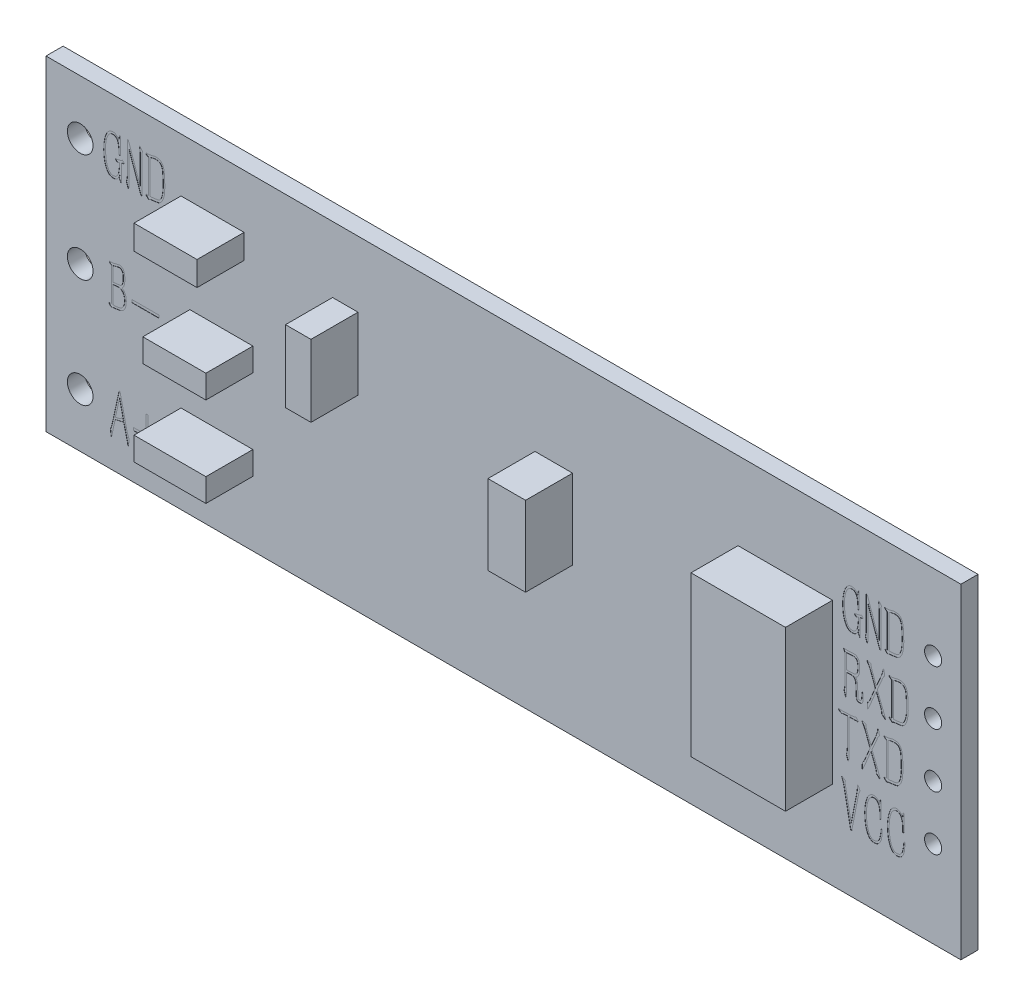
from build123d import *

# Parameters (mm, degrees)
SKETCH_1_W          = 42.8
SKETCH_1_H          = 15.22
EXTRUDE_1_DEPTH     = 0.8
SKETCH_2_W          = 4.420978948
SKETCH_2_H          = 7.451594613
SKETCH_2_W_2        = 1.759404284
SKETCH_2_H_2        = 3.725797306
SKETCH_2_W_3        = 2.949589534
SKETCH_2_H_3        = 1.138438066
SKETCH_2_H_4        = 1.086690881
SKETCH_2_W_4        = 3.363567012
SKETCH_2_W_5        = 1.19018525
SKETCH_2_H_5        = 3.363567013
EXTRUDE_2_DEPTH     = 2.2
SKETCH_3_R          = 0.4
CUT_EXTRUDE_1_DEPTH = 2.2
SKETCH_4_R          = 0.6
CUT_EXTRUDE_2_DEPTH = 2.2
SKETCH_5_W          = 1.270532423
SKETCH_5_H          = 0.127403493
CUT_EXTRUDE_3_DEPTH = 0.01
CUT_EXTRUDE_4_DEPTH = 0.01


with BuildPart() as part:
    # 草图1 → 凸台-拉伸1 (new body)
    with BuildSketch(Plane.XY):
        with Locations((21.4, 7.61)):
            Rectangle(SKETCH_1_W, SKETCH_1_H)
    extrude(amount=EXTRUDE_1_DEPTH)

    # 草图2 → 凸台-拉伸2 (add)
    with BuildSketch(Plane.XY.offset(0.8)):
        with Locations((34.584298007, 7.842862332)):
            Rectangle(SKETCH_2_W, SKETCH_2_H)
        with Locations((23.754496909, 8.774311658)):
            Rectangle(SKETCH_2_W_2, SKETCH_2_H_2)
        with Locations((7.790490395, 12.137878671)):
            Rectangle(SKETCH_2_W_3, SKETCH_2_H_3)
        with Locations((8.204467873, 7.765241555)):
            Rectangle(SKETCH_2_W_3, SKETCH_2_H_4)
        with Locations((7.997479134, 3.573719585)):
            Rectangle(SKETCH_2_W_4, SKETCH_2_H_4)
        with Locations((14.000152572, 10.456095165)):
            Rectangle(SKETCH_2_W_5, SKETCH_2_H_5)
    extrude(amount=EXTRUDE_2_DEPTH)

    # 草图3 → 切除-拉伸1 (cut)
    with BuildSketch(Plane.XY.offset(0.8)):
        with Locations((41.5, 11.67)):
            Circle(SKETCH_3_R)
        with Locations((41.5, 9.13)):
            Circle(SKETCH_3_R)
        with Locations((41.5, 6.59)):
            Circle(SKETCH_3_R)
        with Locations((41.5, 4.05)):
            Circle(SKETCH_3_R)
    extrude(amount=-CUT_EXTRUDE_1_DEPTH, mode=Mode.SUBTRACT)

    # 草图4 → 切除-拉伸2 (cut)
    with BuildSketch(Plane.XY.offset(0.8)):
        with Locations((1.6, 12.68)):
            Circle(SKETCH_4_R)
        with Locations((1.6, 7.6)):
            Circle(SKETCH_4_R)
        with Locations((1.6, 2.52)):
            Circle(SKETCH_4_R)
    extrude(amount=-CUT_EXTRUDE_2_DEPTH, mode=Mode.SUBTRACT)

    # 草图5 → 切除-拉伸3 (cut)
    # profile 1 of 7: a face of its own
    with BuildSketch(Plane.XY.offset(0.8)):
        with BuildLine():
            Line((3.635065829, 2.202136893), (3.233153781, 2.104942476))
            Line((3.233153781, 2.104942476), (3.13858624, 1.664502912))
            Line((3.13858624, 1.664502912), (3.093929346, 1.439905002))
            Line((3.093929346, 1.439905002), (3.076416839, 1.368979347))
            add(Edge.make_bspline(
                [(3.076416839, 1.368979347), (3.074557242, 1.363955373), (3.071421206, 1.355482911), (3.065520394, 1.345514971), (3.059045002, 1.340561421), (3.051815153, 1.339517192), (3.046391212, 1.345786353), (3.04316589, 1.353731389), (3.042200488, 1.365390841), (3.039517882, 1.380571015), (3.037840255, 1.402286736), (3.035915259, 1.418754234), (3.034824633, 1.42808406)],
                knots=[0, 0, 0, 0, 1.226577759, 2.068508672, 2.595953142, 3.064162245, 3.560072257, 4.322224954, 5.029865969, 6.20926766, 7.852322798, 10, 10, 10, 10], degree=3))
            Line((3.034824633, 1.42808406), (3.020376814, 1.551985051))
            add(Edge.make_bspline(
                [(3.020376814, 1.551985051), (3.019442922, 1.562195028), (3.01777685, 1.580409704), (3.016312962, 1.604508527), (3.016217913, 1.621895564), (3.017060448, 1.636441456), (3.021367794, 1.650197152), (3.026484893, 1.659624248), (3.029133068, 1.664502912)],
                knots=[0, 0, 0, 0, 1.603576797, 2.86079302, 3.773774944, 4.323462854, 5.1323669, 6, 6, 6, 6], degree=3))
            Line((3.029133068, 1.664502912), (3.0440187, 1.691209486))
            add(Edge.make_bspline(
                [(3.0440187, 1.691209486), (3.047206802, 1.698165283), (3.054820674, 1.714777221), (3.064461276, 1.745358865), (3.074732305, 1.785176643), (3.085081844, 1.831006197), (3.095226732, 1.875388165), (3.103331275, 1.911551126), (3.109551678, 1.935538828), (3.113597225, 1.947340404), (3.114944355, 1.951270223)],
                knots=[0, 0, 0, 0, 0.679694972, 1.623257572, 2.844174753, 4.335796169, 5.799225578, 6.891200865, 7.630779852, 8, 8, 8, 8], degree=3))
            Line((3.114944355, 1.951270223), (3.419224174, 3.360589268))
            Line((3.419224174, 3.360589268), (3.460378567, 3.360589268))
            Line((3.460378567, 3.360589268), (3.747145878, 2.093121534))
            Line((3.747145878, 2.093121534), (3.782608705, 1.945140845))
            add(Edge.make_bspline(
                [(3.782608705, 1.945140845), (3.786165958, 1.928482672), (3.792547147, 1.89860035), (3.802257504, 1.85891532), (3.810221323, 1.829197036), (3.815821206, 1.812902304), (3.818071533, 1.806354223)],
                knots=[0, 0, 0, 0, 1.425899692, 2.557855139, 3.420470246, 4, 4, 4, 4], degree=3))
            Line((3.818071533, 1.806354223), (3.83864873, 1.750314199))
            add(Edge.make_bspline(
                [(3.83864873, 1.750314199), (3.841017316, 1.74210514), (3.845332788, 1.727148553), (3.852704504, 1.7073537), (3.859949246, 1.692069364), (3.869173597, 1.679196782), (3.878530317, 1.669535424), (3.884988822, 1.659516151), (3.885804745, 1.650162867), (3.884673472, 1.641588223), (3.88346537, 1.630667394), (3.882877537, 1.616916351), (3.881317007, 1.597970546), (3.880627656, 1.583656825), (3.880240935, 1.575626936)],
                knots=[0, 0, 0, 0, 1.645080438, 2.997272953, 4.065812928, 4.892545225, 6.029861332, 6.67147811, 7.124734071, 7.80170629, 8.338742145, 9.240009017, 10.451666043, 12, 12, 12, 12], degree=3))
            Line((3.880240935, 1.575626936), (3.868419992, 1.442969691))
            Line((3.868419992, 1.442969691), (3.862290615, 1.392621232))
            add(Edge.make_bspline(
                [(3.862290615, 1.392621232), (3.861999192, 1.386911401), (3.861481175, 1.376761924), (3.858983873, 1.363688183), (3.857348881, 1.354198251), (3.853904335, 1.347332591), (3.84736, 1.343937737), (3.839246863, 1.346305639), (3.833011206, 1.354511871), (3.831041154, 1.361714831), (3.829892476, 1.365914658)],
                knots=[0, 0, 0, 0, 1.663187075, 2.956388731, 3.874273883, 4.464983498, 5.130530035, 5.83179128, 6.735783313, 8, 8, 8, 8], degree=3))
            Line((3.829892476, 1.365914658), (3.809315279, 1.484124084))
            Line((3.809315279, 1.484124084), (3.635065829, 2.202136893))
        make_face()
        with BuildLine():
            Line((3.628936452, 2.246793788), (3.43980137, 3.076886645))
            Line((3.43980137, 3.076886645), (3.2476016, 2.208266271))
            add(Edge.make_bspline(
                [(3.2476016, 2.208266271), (3.264274818, 2.210836231), (3.293059536, 2.215273021), (3.333179084, 2.224084422), (3.3711496, 2.234514379), (3.404867668, 2.243843923), (3.432719298, 2.253308579), (3.450917117, 2.259571233), (3.464742118, 2.266042288), (3.472095518, 2.270948427), (3.475264198, 2.273062549)],
                knots=[0, 0, 0, 0, 1.70172219, 2.937860729, 4.141475294, 5.674569601, 6.46612829, 7.108957565, 7.616037637, 8, 8, 8, 8], degree=3))
            Line((3.475264198, 2.273062549), (3.549254542, 2.323411008))
            Line((3.549254542, 2.323411008), (3.628936452, 2.246793788))
        make_face(mode=Mode.SUBTRACT)
    # profile 2 of 7: a face of its own
    with BuildSketch(Plane.XY.offset(0.8)):
        Polygon((4.676184403, 2.217022525), (4.676184403, 3.059374138), (4.764622566, 3.059374138), (4.764622566, 2.217022525), (5.355669696, 2.217022525), (5.355669696, 2.090056845), (4.764622566, 2.090056845), (4.764622566, 1.247705232), (4.676184403, 1.247705232), (4.676184403, 2.090056845), (4.085137273, 2.090056845), (4.085137273, 2.217022525), align=None)
    # profile 3 of 7: a face of its own
    with BuildSketch(Plane.XY.offset(0.8)):
        with BuildLine():
            add(Edge.make_bspline(
                [(3.059614909, 8.273995379), (3.052465739, 8.279536069), (3.039500208, 8.289584507), (3.020067512, 8.304697721), (3.001835256, 8.324554271), (2.984692714, 8.343015938), (2.971168134, 8.359918867), (2.964320452, 8.371230137), (2.959685252, 8.380010417), (2.960402979, 8.38903106), (2.965342826, 8.395929465), (2.970128928, 8.404964935), (2.983284136, 8.407388116), (2.997816258, 8.401923123), (3.013273223, 8.397328987), (3.025439907, 8.393329042), (3.036126724, 8.39299964), (3.048820657, 8.392945162), (3.067051719, 8.394210044), (3.089257125, 8.394651165), (3.111779225, 8.39618643), (3.131250205, 8.398722756), (3.146137196, 8.400076554), (3.154062444, 8.4028937), (3.157247138, 8.404025747)],
                knots=[0, 0, 0, 0, 1.64763205, 2.988098512, 4.472525849, 6.542356651, 7.584071831, 8.395257026, 8.967619365, 9.340564694, 9.97047718, 10.50190227, 11.107820098, 12.171334353, 13.314207223, 14.055349962, 14.481319576, 15.251885957, 16.369143228, 17.804974755, 19.296756072, 20.473415709, 21.386554954, 22, 22, 22, 22], degree=3))
            Line((3.157247138, 8.404025747), (3.305227827, 8.442115451))
            add(Edge.make_bspline(
                [(3.305227827, 8.442115451), (3.309739731, 8.443335163), (3.319724296, 8.44603431), (3.336640331, 8.449250161), (3.3565595, 8.453827291), (3.378938832, 8.458235995), (3.401134248, 8.463245804), (3.421384915, 8.465914576), (3.438104445, 8.468687956), (3.448238106, 8.468780591), (3.452770703, 8.468822025)],
                knots=[0, 0, 0, 0, 0.746644526, 1.652278328, 2.750112717, 4.012480095, 5.297690843, 6.382818677, 7.276664985, 8, 8, 8, 8], degree=3))
            add(Edge.make_bspline(
                [(3.452770703, 8.468822025), (3.462444008, 8.467769834), (3.48177207, 8.465667469), (3.510160798, 8.457781358), (3.537116749, 8.444630609), (3.562886652, 8.427724759), (3.586385333, 8.406569336), (3.607815142, 8.382201556), (3.626189002, 8.354034422), (3.641480169, 8.321957539), (3.65447711, 8.286442069), (3.665574699, 8.246944906), (3.67394175, 8.203399433), (3.68073089, 8.157067606), (3.685816535, 8.110611219), (3.689249424, 8.066360803), (3.691598303, 8.025633979), (3.692042335, 7.999635504), (3.692254244, 7.987228067)],
                knots=[0, 0, 0, 0, 0.788100513, 1.574689806, 2.373814472, 3.210589555, 4.065404581, 4.929098289, 5.834801075, 6.781980012, 7.803943584, 8.897694274, 10.10426717, 11.396006919, 12.693423483, 13.892139677, 14.994050896, 16, 16, 16, 16], degree=3))
            add(Edge.make_bspline(
                [(3.692254244, 7.987228067), (3.690991095, 7.967363532), (3.688440009, 7.927244649), (3.680909661, 7.866556906), (3.669610257, 7.804290139), (3.65615425, 7.752756861), (3.643821471, 7.71412187), (3.634492865, 7.691067284), (3.626166205, 7.673384929), (3.618435307, 7.665312358), (3.615199211, 7.66193324)],
                knots=[0, 0, 0, 0, 1.41233288, 2.852380741, 4.337314802, 5.89979107, 6.630150315, 7.21096505, 7.669715816, 8, 8, 8, 8], degree=3))
            Line((3.615199211, 7.66193324), (3.553467622, 7.600201651))
            add(Edge.make_bspline(
                [(3.553467622, 7.600201651), (3.566784377, 7.591107163), (3.590878403, 7.574652494), (3.61815443, 7.551580027), (3.637672265, 7.53190657), (3.652054031, 7.512414906), (3.668504156, 7.48861904), (3.691781783, 7.449903422), (3.719564319, 7.39472729), (3.737232372, 7.332532657), (3.747977345, 7.277828559), (3.752188845, 7.230909664), (3.755066353, 7.179208641), (3.754644059, 7.143130215), (3.754423646, 7.124299258)],
                knots=[0, 0, 0, 0, 1.070182896, 1.936283469, 2.368030692, 2.906882123, 3.541225939, 4.289096852, 5.905680189, 7.625612947, 8.562596306, 9.604952081, 10.749916543, 12, 12, 12, 12], degree=3))
            add(Edge.make_bspline(
                [(3.754423646, 7.124299258), (3.753706018, 7.106486759), (3.75230967, 7.071827514), (3.747637664, 7.021215858), (3.739907167, 6.973523955), (3.731190365, 6.928477026), (3.719244126, 6.886627522), (3.70504186, 6.848128815), (3.687822547, 6.812995555), (3.667558951, 6.781388772), (3.644737813, 6.752695947), (3.618896957, 6.727019395), (3.590465545, 6.703817089), (3.559187963, 6.683222183), (3.525718864, 6.665240081), (3.489648784, 6.650833608), (3.451644363, 6.638797364), (3.425104912, 6.633550872), (3.41161631, 6.630884358)],
                knots=[0, 0, 0, 0, 1.291181941, 2.512358873, 3.678492505, 4.789671877, 5.833657235, 6.827132701, 7.758433233, 8.661592748, 9.541502867, 10.408556622, 11.295108621, 12.19516981, 13.117306623, 14.041863747, 15.004782726, 16, 16, 16, 16], degree=3))
            Line((3.41161631, 6.630884358), (3.239993736, 6.607242473))
            add(Edge.make_bspline(
                [(3.239993736, 6.607242473), (3.230815725, 6.605665531), (3.21351765, 6.60269342), (3.189143839, 6.600294644), (3.168413722, 6.596504279), (3.146256074, 6.59500362), (3.12279496, 6.590688047), (3.101627844, 6.578565372), (3.090480222, 6.565402191), (3.082874738, 6.561199238), (3.080629918, 6.559958702)],
                knots=[0, 0, 0, 0, 1.312917143, 2.474494646, 3.452532002, 4.279929402, 5.608244096, 6.780169529, 7.639957153, 8, 8, 8, 8], degree=3))
            add(Edge.make_bspline(
                [(3.080629918, 6.559958702), (3.078372034, 6.559708339), (3.072648791, 6.559073722), (3.066206262, 6.565215165), (3.059177088, 6.571888347), (3.049874157, 6.578981346), (3.038264442, 6.588862644), (3.0187254, 6.60310146), (2.995986763, 6.622828378), (2.974494896, 6.647569327), (2.96076347, 6.669026713), (2.953081571, 6.686216647), (2.951636706, 6.696868739), (2.950913429, 6.705672396), (2.961882899, 6.708588691), (2.96912544, 6.709747621), (2.974241434, 6.710566267)],
                knots=[0, 0, 0, 0, 0.408406666, 1.035221836, 1.516918604, 2.252554637, 3.200824533, 4.366195779, 6.758465887, 8.80503204, 10.444321207, 11.5313617, 12.220697094, 12.548554928, 12.974726626, 14, 14, 14, 14], degree=3))
            Line((2.974241434, 6.710566267), (3.059614909, 6.710566267))
            Line((3.059614909, 6.710566267), (3.059614909, 8.273995379))
        make_face()
        with BuildLine():
            Line((3.136669942, 7.623843536), (3.370024105, 7.650112297))
            add(Edge.make_bspline(
                [(3.370024105, 7.650112297), (3.381994974, 7.651683147), (3.404504412, 7.654636896), (3.435781047, 7.659257728), (3.462162078, 7.664270993), (3.484826219, 7.668548783), (3.504924765, 7.676641797), (3.522557894, 7.6904214), (3.539002614, 7.708887949), (3.558908726, 7.740223622), (3.580661625, 7.78392077), (3.59894088, 7.840794268), (3.610804951, 7.900758614), (3.613062359, 7.963578168), (3.61245179, 8.027063022), (3.61253243, 8.069534867), (3.612572335, 8.090551862)],
                knots=[0, 0, 0, 0, 0.873777503, 1.643008589, 2.287243073, 2.817622504, 3.309938555, 3.837999608, 4.421262104, 5.092045153, 6.518435707, 7.941185456, 9.403523715, 10.926684676, 12.47918417, 14, 14, 14, 14], degree=3))
            add(Edge.make_bspline(
                [(3.612572335, 8.090551862), (3.611592568, 8.103707904), (3.609724888, 8.128786607), (3.604121449, 8.164350066), (3.598398564, 8.196180929), (3.588624602, 8.23254741), (3.572456355, 8.272828239), (3.547793204, 8.306428424), (3.525349246, 8.327760511), (3.50813451, 8.340620121), (3.489523638, 8.348918974), (3.465077956, 8.354841162), (3.436484433, 8.35750742), (3.408966722, 8.356115182), (3.387234417, 8.352121227), (3.367770285, 8.348760035), (3.344954818, 8.343738957), (3.328439022, 8.340506707), (3.319675646, 8.338791656)],
                knots=[0, 0, 0, 0, 1.337822755, 2.550224273, 3.650783, 4.616944903, 6.368664393, 8.021145033, 8.796181901, 9.507039394, 10.189576941, 10.84675067, 12.051897664, 13.090030714, 13.630410622, 14.292569305, 15.094027531, 16, 16, 16, 16], degree=3))
            Line((3.319675646, 8.338791656), (3.136669942, 8.291507886))
            Line((3.136669942, 8.291507886), (3.136669942, 7.623843536))
        make_face(mode=Mode.SUBTRACT)
        with BuildLine():
            add(Edge.make_bspline(
                [(3.136669942, 6.710566267), (3.149361522, 6.709624942), (3.172686091, 6.707894976), (3.204374643, 6.706452205), (3.229634012, 6.70648538), (3.25028215, 6.707112688), (3.27031659, 6.71013438), (3.293622722, 6.712190073), (3.321961872, 6.716768191), (3.365483415, 6.721635433), (3.419354333, 6.732125193), (3.471150539, 6.745511428), (3.508372962, 6.762169201), (3.534279995, 6.779552581), (3.559143858, 6.801714785), (3.588856272, 6.837730211), (3.621759708, 6.884936913), (3.648492227, 6.945482464), (3.666131943, 7.00516377), (3.673757255, 7.064678721), (3.676402139, 7.122972681), (3.674997813, 7.161367872), (3.674303924, 7.180339282)],
                knots=[0, 0, 0, 0, 0.898162711, 1.650642252, 2.237699247, 2.68104558, 3.106443072, 3.666024881, 4.33166218, 5.131363942, 6.755447525, 8.202702255, 8.893980373, 9.622392647, 10.39559097, 11.23565845, 12.912443945, 14.438192962, 15.885447693, 17.289548788, 18.660741617, 20, 20, 20, 20], degree=3))
            add(Edge.make_bspline(
                [(3.674303924, 7.180339282), (3.671946558, 7.204912267), (3.667412558, 7.252174315), (3.654185818, 7.319644426), (3.633875437, 7.380835431), (3.602597316, 7.433422257), (3.564345474, 7.477537775), (3.520068714, 7.510728398), (3.474679023, 7.532887292), (3.435937814, 7.543759457), (3.402461895, 7.546344488), (3.370734873, 7.546676272), (3.331454781, 7.544621264), (3.302886208, 7.542342152), (3.287277507, 7.541096938)],
                knots=[0, 0, 0, 0, 1.438130322, 2.76600445, 4.000792246, 5.175154235, 6.308219456, 7.383388526, 8.376306419, 9.238740087, 9.708503365, 10.329505009, 11.087309779, 12, 12, 12, 12], degree=3))
            Line((3.287277507, 7.541096938), (3.136669942, 7.523146617))
            Line((3.136669942, 7.523146617), (3.136669942, 6.710566267))
        make_face(mode=Mode.SUBTRACT)
    # profile 4 of 7: a face of its own
    with BuildSketch(Plane.XY.offset(0.8)):
        with Locations((4.65062622, 7.300081053)):
            Rectangle(SKETCH_5_W, SKETCH_5_H)
    # profile 5 of 7: a face of its own
    with BuildSketch(Plane.XY.offset(0.8)):
        with BuildLine():
            add(Edge.make_bspline(
                [(3.439025961, 12.624383239), (3.431404262, 12.621396097), (3.41769703, 12.616023877), (3.399969557, 12.607913728), (3.386680397, 12.602421431), (3.379619814, 12.599011276), (3.376856559, 12.597676665)],
                knots=[0, 0, 0, 0, 1.451194949, 2.609899258, 3.455965341, 4, 4, 4, 4], degree=3))
            Line((3.376856559, 12.597676665), (3.341393731, 12.580164158))
            Line((3.341393731, 12.580164158), (3.258647133, 12.656781378))
            add(Edge.make_bspline(
                [(3.258647133, 12.656781378), (3.253496263, 12.660627801), (3.24570318, 12.6664473), (3.237710941, 12.678100926), (3.241721985, 12.685216803), (3.243220861, 12.691473281), (3.249140985, 12.695450387), (3.25352457, 12.697313096), (3.256020257, 12.698373584)],
                knots=[0, 0, 0, 0, 2.086102323, 3.156198184, 3.883632954, 4.481724143, 5.135606675, 6, 6, 6, 6], degree=3))
            Line((3.256020257, 12.698373584), (3.326945913, 12.698373584))
            Line((3.326945913, 12.698373584), (3.388677502, 12.712821403))
            Line((3.388677502, 12.712821403), (3.465732535, 12.727707034))
            add(Edge.make_bspline(
                [(3.465732535, 12.727707034), (3.471179642, 12.728572841), (3.485364802, 12.730827544), (3.506724601, 12.739590187), (3.528986125, 12.748045031), (3.538618085, 12.758946392), (3.542349756, 12.763169862)],
                knots=[0, 0, 0, 0, 0.766069967, 1.994971973, 3.223200239, 4, 4, 4, 4], degree=3))
            Line((3.542349756, 12.763169862), (3.560300076, 12.792941125))
            Line((3.560300076, 12.792941125), (3.648738239, 12.712821403))
            add(Edge.make_bspline(
                [(3.648738239, 12.712821403), (3.652084849, 12.708779521), (3.658543312, 12.700979288), (3.660867306, 12.687231247), (3.660778593, 12.675466493), (3.656546277, 12.67055168), (3.654867617, 12.668602321)],
                knots=[0, 0, 0, 0, 1.265348548, 2.441935808, 3.382026096, 4, 4, 4, 4], degree=3))
            Line((3.654867617, 12.668602321), (3.63429042, 12.665537632))
            Line((3.63429042, 12.665537632), (3.521772559, 12.648025125))
            Line((3.521772559, 12.648025125), (3.521772559, 11.912061995))
            add(Edge.make_bspline(
                [(3.521772559, 11.912061995), (3.521817204, 11.903596594), (3.521901113, 11.887686049), (3.521361909, 11.865658652), (3.520930883, 11.847103112), (3.520554478, 11.832265386), (3.519996757, 11.820697098), (3.518359564, 11.813250436), (3.517868216, 11.808299705), (3.512458246, 11.804833846), (3.506855594, 11.822186622), (3.495907304, 11.832462249), (3.486721707, 11.850053785), (3.482305848, 11.860706789), (3.480618166, 11.864778225)],
                knots=[0, 0, 0, 0, 1.751209942, 3.291362944, 4.559839881, 5.586855149, 6.374199429, 6.925174992, 7.211613548, 7.320476949, 8.136254313, 9.593373124, 11.080219477, 12, 12, 12, 12], degree=3))
            Line((3.480618166, 11.864778225), (3.465732535, 11.903305741))
            Line((3.465732535, 11.903305741), (3.439025961, 11.9536542))
            add(Edge.make_bspline(
                [(3.439025961, 11.9536542), (3.434826935, 11.961504447), (3.427370164, 11.975445179), (3.42512236, 11.991054024), (3.42414033, 11.997873282)],
                knots=[0, 0, 0, 0, 1.126231633, 2, 2, 2, 2], degree=3))
            Line((3.42414033, 11.997873282), (3.433334396, 12.027206732))
            Line((3.433334396, 12.027206732), (3.450846904, 12.133595215))
            add(Edge.make_bspline(
                [(3.450846904, 12.133595215), (3.447430425, 12.124860654), (3.439053274, 12.103443646), (3.426493515, 12.065904177), (3.409031042, 12.019867446), (3.389150582, 11.978845645), (3.369284931, 11.945150219), (3.349035228, 11.922356655), (3.325605415, 11.901519579), (3.298817274, 11.883381441), (3.269650518, 11.86889862), (3.239524314, 11.856867241), (3.207981524, 11.850123947), (3.186578722, 11.848217082), (3.175900535, 11.847265717)],
                knots=[0, 0, 0, 0, 0.787433887, 1.930775596, 3.32352342, 4.918383998, 5.754919964, 6.59762641, 7.465700887, 8.383390173, 9.30410181, 10.196234789, 11.100073855, 12, 12, 12, 12], degree=3))
            add(Edge.make_bspline(
                [(3.175900535, 11.847265717), (3.156457158, 11.846339423), (3.117688367, 11.844492454), (3.0605937, 11.855594677), (3.007842225, 11.876122074), (2.966758302, 11.898552905), (2.937348331, 11.922075848), (2.916353914, 11.943576802), (2.895125399, 11.9679598), (2.875140507, 11.996786289), (2.855298783, 12.029333599), (2.836200574, 12.06634908), (2.817023466, 12.107366643), (2.798111043, 12.152366976), (2.780835681, 12.201069723), (2.765068595, 12.253115029), (2.750588683, 12.308138256), (2.734225565, 12.384375306), (2.718155463, 12.477522415), (2.706280049, 12.587074331), (2.701639638, 12.696430308), (2.699633783, 12.811181823), (2.70247763, 12.93313757), (2.710691176, 13.016262422), (2.714883774, 13.058693427)],
                knots=[0, 0, 0, 0, 0.886537814, 1.767696987, 2.630539397, 3.466390029, 3.89319088, 4.345660666, 4.837284351, 5.368061509, 5.945350042, 6.577414686, 7.26921622, 8.013189797, 8.805909171, 9.628228833, 10.496409839, 11.40375193, 13.18882713, 14.811163384, 16.432855943, 18.186087669, 20.053191931, 22, 22, 22, 22], degree=3))
            add(Edge.make_bspline(
                [(2.714883774, 13.058693427), (2.719781956, 13.094065606), (2.729870717, 13.166921508), (2.748325583, 13.258036143), (2.767780807, 13.331854418), (2.785251186, 13.386732518), (2.805796572, 13.440122037), (2.82911797, 13.491191741), (2.854318599, 13.538154276), (2.880871324, 13.579352481), (2.908988826, 13.613417633), (2.937981619, 13.640714469), (2.966609809, 13.661833918), (2.992597104, 13.679140905), (3.016664094, 13.691795253), (3.04603457, 13.702936578), (3.083318111, 13.710653218), (3.113263245, 13.713509942), (3.128616765, 13.714974647)],
                knots=[0, 0, 0, 0, 2.031066659, 4.183377905, 5.28281558, 6.372336155, 7.457674051, 8.534949753, 9.563865233, 10.48716063, 11.318346232, 12.070077728, 12.745820699, 13.339884663, 13.84484432, 14.288876811, 15.122670028, 16, 16, 16, 16], degree=3))
            add(Edge.make_bspline(
                [(3.128616765, 13.714974647), (3.138268734, 13.714780386), (3.15709541, 13.71440147), (3.184514707, 13.709744234), (3.210509856, 13.702800767), (3.243674973, 13.689760077), (3.28333954, 13.665874768), (3.317117961, 13.633447712), (3.341673729, 13.606231535), (3.357833875, 13.588309061), (3.370098798, 13.572534318), (3.376894694, 13.562642865), (3.379921248, 13.558237704)],
                knots=[0, 0, 0, 0, 0.935591886, 1.824921544, 2.69059853, 3.542616212, 5.276632114, 7.140836838, 8.062935201, 8.835586858, 9.48142842, 10, 10, 10, 10], degree=3))
            Line((3.379921248, 13.558237704), (3.403563133, 13.510953934))
            Line((3.403563133, 13.510953934), (3.439025961, 13.720666212))
            Line((3.439025961, 13.720666212), (3.474488789, 13.720666212))
            Line((3.474488789, 13.720666212), (3.474488789, 12.919906804))
            Line((3.474488789, 12.919906804), (3.412319387, 12.916842115))
            add(Edge.make_bspline(
                [(3.412319387, 12.916842115), (3.41230888, 12.930852119), (3.412286335, 12.960915251), (3.412478564, 13.008055626), (3.411684922, 13.05813023), (3.409800332, 13.101181831), (3.40754454, 13.137525131), (3.404713136, 13.168436469), (3.401928234, 13.203228238), (3.395892228, 13.252832554), (3.388953374, 13.31293472), (3.375188164, 13.379524969), (3.356409523, 13.440625825), (3.332334268, 13.48689179), (3.310922047, 13.522197503), (3.292219231, 13.544436199), (3.272926298, 13.563845532), (3.244798904, 13.58408299), (3.204826043, 13.603055656), (3.170152099, 13.608436343), (3.15225865, 13.61121304)],
                knots=[0, 0, 0, 0, 0.934719612, 2.005752502, 3.145108456, 4.275610044, 4.880538166, 5.574305271, 6.346515312, 7.208856073, 8.908119904, 10.380417914, 11.741392999, 13.156562568, 13.848071288, 14.491354542, 15.090376944, 15.668787155, 16.796980267, 18, 18, 18, 18], degree=3))
            add(Edge.make_bspline(
                [(3.15225865, 13.61121304), (3.138365453, 13.61120783), (3.111398297, 13.611197719), (3.071881592, 13.603929054), (3.035166371, 13.590741702), (3.0005194, 13.572011036), (2.968416096, 13.546500692), (2.939207763, 13.513390824), (2.91139597, 13.473694326), (2.886953739, 13.427298735), (2.864545791, 13.37737933), (2.845288948, 13.325401907), (2.828866488, 13.272414903), (2.812731677, 13.20130891), (2.798022468, 13.114333723), (2.788007257, 13.012623213), (2.783965894, 12.91396088), (2.783443196, 12.848983739), (2.783182553, 12.81658301)],
                knots=[0, 0, 0, 0, 0.687070091, 1.333625864, 1.978401157, 2.612429783, 3.276252408, 3.997857604, 4.791996822, 5.671793893, 6.590722303, 7.501081097, 8.415734735, 9.336282353, 11.110559688, 12.781456087, 14.395079127, 16, 16, 16, 16], degree=3))
            add(Edge.make_bspline(
                [(2.783182553, 12.81658301), (2.783892844, 12.773658837), (2.785363865, 12.684762422), (2.794627299, 12.57308554), (2.805443346, 12.482825126), (2.815224736, 12.418045856), (2.827702821, 12.357676592), (2.841009607, 12.301668729), (2.855947571, 12.250828267), (2.870860689, 12.205334909), (2.885083198, 12.165113558), (2.900081058, 12.130197962), (2.915613428, 12.099510397), (2.931614071, 12.072272208), (2.948974101, 12.048418993), (2.971979465, 12.021069519), (3.003086991, 11.994260699), (3.041641972, 11.968599358), (3.083831778, 11.952504713), (3.113452401, 11.949211032), (3.128616765, 11.947524823)],
                knots=[0, 0, 0, 0, 2.298361562, 4.759931027, 5.995784954, 7.166237941, 8.266635837, 9.295830317, 10.247969411, 11.103023622, 11.859473385, 12.531579901, 13.136194532, 13.700421914, 14.220962996, 14.714278152, 15.611161906, 16.408908565, 17.185436095, 18, 18, 18, 18], degree=3))
            add(Edge.make_bspline(
                [(3.128616765, 11.947524823), (3.14251219, 11.947339275), (3.170403479, 11.946966838), (3.212219624, 11.955171491), (3.25271448, 11.971172406), (3.290439084, 11.997068016), (3.324287463, 12.032304333), (3.353718542, 12.076464606), (3.378539852, 12.127497223), (3.395682452, 12.184324785), (3.408739988, 12.243222078), (3.416929821, 12.303060569), (3.423222301, 12.361070103), (3.428713264, 12.417837817), (3.433374661, 12.475470122), (3.435074386, 12.514921993), (3.435961272, 12.535507264)],
                knots=[0, 0, 0, 0, 0.783104963, 1.571870426, 2.389098297, 3.225710409, 4.134881124, 5.131509479, 6.211508184, 7.327051887, 8.474825503, 9.6158629, 10.735296491, 11.77020564, 12.836533725, 14, 14, 14, 14], degree=3))
            Line((3.435961272, 12.535507264), (3.439025961, 12.624383239))
        make_face()
    # profile 6 of 7: a face of its own
    with BuildSketch(Plane.XY.offset(0.8)):
        with BuildLine():
            Line((4.364999798, 13.741243408), (4.391706372, 13.767949982))
            Line((4.391706372, 13.767949982), (4.518672051, 13.61121304))
            add(Edge.make_bspline(
                [(4.518672051, 13.61121304), (4.515905547, 13.601677148), (4.510553094, 13.583227723), (4.501655061, 13.560688829), (4.496372562, 13.541145139), (4.49288534, 13.523302542), (4.489950008, 13.501955172), (4.486708361, 13.470883045), (4.484502473, 13.435094372), (4.483598416, 13.407631738), (4.483209223, 13.395809197)],
                knots=[0, 0, 0, 0, 1.084494799, 2.098210167, 2.643672211, 3.294173657, 4.083496456, 4.997481927, 6.707429351, 8, 8, 8, 8], degree=3))
            Line((4.483209223, 13.395809197), (4.483209223, 11.796917258))
            Line((4.483209223, 11.796917258), (4.438990142, 11.796917258))
            Line((4.438990142, 11.796917258), (3.88340584, 13.380923565))
            Line((3.88340584, 13.380923565), (3.88340584, 12.036400799))
            add(Edge.make_bspline(
                [(3.88340584, 12.036400799), (3.883269019, 12.025309958), (3.882977346, 12.00166665), (3.882312033, 11.963841322), (3.879792399, 11.921706084), (3.877375559, 11.877689932), (3.874994936, 11.837892671), (3.871137474, 11.806455908), (3.868896948, 11.788441853), (3.862951359, 11.775206218), (3.850780185, 11.78028935), (3.841197828, 11.790909924), (3.830573171, 11.811340379), (3.824724951, 11.828083962), (3.821236438, 11.838071651)],
                knots=[0, 0, 0, 0, 1.182286761, 2.52038347, 4.031227312, 5.682702803, 7.210982332, 8.306924227, 8.990285397, 9.270708198, 9.606495757, 10.101576878, 10.867574663, 12, 12, 12, 12], degree=3))
            Line((3.821236438, 11.838071651), (3.773952668, 11.971166708))
            add(Edge.make_bspline(
                [(3.773952668, 11.971166708), (3.770860536, 11.979655275), (3.765658395, 11.993936274), (3.762146439, 12.015530152), (3.767604534, 12.036463508), (3.773226189, 12.056629024), (3.778779382, 12.078070499), (3.783587342, 12.099500054), (3.788336573, 12.125361157), (3.793002644, 12.155594072), (3.798291376, 12.190080355), (3.800744842, 12.228871906), (3.803358816, 12.271617949), (3.80331112, 12.301417901), (3.803286118, 12.317038732)],
                knots=[0, 0, 0, 0, 0.927779361, 1.560877733, 2.200839638, 3.115853294, 3.718492711, 4.470182357, 5.368516448, 6.414355644, 7.608241643, 8.944514625, 10.398345751, 12, 12, 12, 12], degree=3))
            Line((3.803286118, 12.317038732), (3.803286118, 13.747372786))
            Line((3.803286118, 13.747372786), (3.847943012, 13.747372786))
            Line((3.847943012, 13.747372786), (4.403527314, 12.157237101))
            Line((4.403527314, 12.157237101), (4.403527314, 13.392744508))
            add(Edge.make_bspline(
                [(4.403527314, 13.392744508), (4.403264486, 13.416975216), (4.402746474, 13.464731945), (4.399609654, 13.523240661), (4.396676688, 13.566859293), (4.3945274, 13.594737632), (4.392411526, 13.617956171), (4.389466413, 13.642512537), (4.385454313, 13.669649003), (4.379663115, 13.690067448), (4.37682074, 13.700089016)],
                knots=[0, 0, 0, 0, 1.880234277, 3.705786779, 4.545737466, 5.272737238, 5.875620033, 6.354622927, 7.192433219, 8, 8, 8, 8], degree=3))
            Line((4.37682074, 13.700089016), (4.364999798, 13.741243408))
        make_face()
    # profile 7 of 7: a face of its own
    with BuildSketch(Plane.XY.offset(0.8)):
        with BuildLine():
            add(Edge.make_bspline(
                [(4.785737791, 13.514018623), (4.77803238, 13.517452679), (4.764692552, 13.523397816), (4.752401651, 13.531270564), (4.747210275, 13.534595819)],
                knots=[0, 0, 0, 0, 1.155249011, 2, 2, 2, 2], degree=3))
            Line((4.747210275, 13.534595819), (4.694234939, 13.578814901))
            add(Edge.make_bspline(
                [(4.694234939, 13.578814901), (4.689053964, 13.582649195), (4.679661316, 13.589600429), (4.669704212, 13.602590736), (4.665996539, 13.615693385), (4.666922308, 13.627374667), (4.671153271, 13.637511851), (4.676648945, 13.641895188), (4.679349308, 13.644048991)],
                knots=[0, 0, 0, 0, 1.447871613, 2.624862772, 3.613765279, 4.438196654, 5.232590026, 6, 6, 6, 6], degree=3))
            Line((4.679349308, 13.644048991), (4.732762456, 13.634854925))
            Line((4.732762456, 13.634854925), (4.794494045, 13.634854925))
            add(Edge.make_bspline(
                [(4.794494045, 13.634854925), (4.795516349, 13.634996235), (4.799771459, 13.635584409), (4.809242325, 13.637445642), (4.824965184, 13.64055567), (4.837539723, 13.642765571), (4.844842504, 13.644048991)],
                knots=[0, 0, 0, 0, 0.241932977, 1.006992227, 2.261782692, 4, 4, 4, 4], degree=3))
            Line((4.844842504, 13.644048991), (4.907011906, 13.649740556))
            Line((4.907011906, 13.649740556), (5.019091954, 13.682138695))
            add(Edge.make_bspline(
                [(5.019091954, 13.682138695), (5.028405445, 13.684454469), (5.047921157, 13.689306998), (5.079109858, 13.69430512), (5.113129759, 13.698400269), (5.136851074, 13.699513257), (5.149122323, 13.700089016)],
                knots=[0, 0, 0, 0, 0.875268756, 1.834059148, 2.879539399, 4, 4, 4, 4], degree=3))
            add(Edge.make_bspline(
                [(5.149122323, 13.700089016), (5.161535001, 13.699958466), (5.185223071, 13.699709327), (5.219233721, 13.696810265), (5.250354295, 13.693332391), (5.287289113, 13.685048505), (5.330002303, 13.670689653), (5.375189667, 13.642023585), (5.414713322, 13.604468145), (5.442504278, 13.566169495), (5.462032192, 13.530895254), (5.476059518, 13.500657148), (5.48860886, 13.466945856), (5.499916202, 13.429903763), (5.51042162, 13.389765491), (5.519630683, 13.346085465), (5.527429246, 13.298892736), (5.53582712, 13.232064515), (5.544003604, 13.148176516), (5.548062461, 13.048348843), (5.551519175, 12.948508557), (5.554460217, 12.864873397), (5.557719514, 12.799085745), (5.558895856, 12.754124748), (5.559844395, 12.714138284), (5.560106526, 12.689033999), (5.560228438, 12.677358575)],
                knots=[0, 0, 0, 0, 0.718585689, 1.371332375, 1.976198466, 2.529891817, 3.561749994, 4.56781114, 5.602123862, 6.702587104, 7.292809697, 7.935632291, 8.631030849, 9.374196065, 10.177765977, 11.033092299, 11.958456765, 12.947006156, 14.933404235, 16.837287687, 18.73165533, 20.719239715, 21.683649529, 22.54608654, 23.323818374, 24, 24, 24, 24], degree=3))
            add(Edge.make_bspline(
                [(5.560228438, 12.677358575), (5.559650262, 12.664369952), (5.558422295, 12.636783876), (5.556352748, 12.592986554), (5.553062636, 12.544409068), (5.548765849, 12.473952158), (5.540499025, 12.384296436), (5.524374349, 12.296296471), (5.508494527, 12.228194428), (5.492578823, 12.179884746), (5.474146038, 12.133465393), (5.453010005, 12.089889642), (5.429856525, 12.049773757), (5.40605718, 12.013933286), (5.381312082, 11.982720657), (5.355562235, 11.956354467), (5.32832596, 11.934283633), (5.299160749, 11.916629641), (5.267928106, 11.902993069), (5.233568183, 11.893183246), (5.194350089, 11.886001487), (5.148145873, 11.87921239), (5.093886967, 11.871629844), (5.054858308, 11.867166277), (5.033977586, 11.864778225)],
                knots=[0, 0, 0, 0, 0.774403953, 1.64472916, 2.611501509, 3.674251025, 5.849538744, 7.968932488, 8.997760875, 10.012092789, 10.995102175, 11.970898344, 12.893807862, 13.752068917, 14.531287561, 15.26274097, 15.942861734, 16.613698282, 17.287120385, 17.96651865, 18.737058996, 19.660295931, 20.748234995, 22, 22, 22, 22], degree=3))
            Line((5.033977586, 11.864778225), (4.903947217, 11.849892593))
            add(Edge.make_bspline(
                [(4.903947217, 11.849892593), (4.891496814, 11.847766337), (4.868765874, 11.843884389), (4.844132984, 11.831638828), (4.829511148, 11.821581646), (4.821663263, 11.816231771), (4.816277494, 11.812976549), (4.813328691, 11.81207366), (4.812444365, 11.811802889)],
                knots=[0, 0, 0, 0, 2.258427549, 4.123254342, 4.879658115, 5.446960944, 5.834147501, 6, 6, 6, 6], degree=3))
            add(Edge.make_bspline(
                [(4.812444365, 11.811802889), (4.809910396, 11.811745844), (4.803516225, 11.811601899), (4.793723645, 11.818396088), (4.78056302, 11.826901161), (4.766334009, 11.839849744), (4.752134384, 11.85334471), (4.739686899, 11.865134914), (4.730517906, 11.874664779), (4.725594166, 11.880377967), (4.72356839, 11.882728545)],
                knots=[0, 0, 0, 0, 0.515294809, 1.300285127, 2.366249425, 3.803798064, 5.259385994, 6.436385369, 7.356681581, 8, 8, 8, 8], degree=3))
            Line((4.72356839, 11.882728545), (4.688105562, 11.920818249))
            add(Edge.make_bspline(
                [(4.688105562, 11.920818249), (4.682895468, 11.92636579), (4.674868982, 11.934912135), (4.6671625, 11.949255893), (4.671119818, 11.9578687), (4.674740082, 11.964981171), (4.685157209, 11.96718727), (4.692582122, 11.966140329), (4.697299628, 11.965475143)],
                knots=[0, 0, 0, 0, 1.90810625, 2.939560931, 3.619271678, 4.135931338, 4.815642084, 6, 6, 6, 6], degree=3))
            Line((4.697299628, 11.965475143), (4.738454021, 11.965475143))
            Line((4.738454021, 11.965475143), (4.785737791, 11.965475143))
            Line((4.785737791, 11.965475143), (4.785737791, 13.514018623))
        make_face()
        with BuildLine():
            add(Edge.make_bspline(
                [(4.868484389, 11.971166708), (4.878114102, 11.97058528), (4.896051807, 11.969502227), (4.921017061, 11.970074789), (4.941925815, 11.969389898), (4.954445634, 11.970621547), (4.959987241, 11.971166708)],
                knots=[0, 0, 0, 0, 1.263335509, 2.353272607, 3.271114373, 4, 4, 4, 4], degree=3))
            Line((4.959987241, 11.971166708), (5.09001761, 11.986052339))
            add(Edge.make_bspline(
                [(5.09001761, 11.986052339), (5.106960599, 11.987810583), (5.139486272, 11.991185905), (5.185973739, 11.998239788), (5.227741693, 12.008556852), (5.265826254, 12.020299763), (5.300316623, 12.037559639), (5.330495233, 12.062379581), (5.357195798, 12.094122742), (5.378856512, 12.132403026), (5.397787072, 12.173333335), (5.415290793, 12.214094341), (5.428165321, 12.254716617), (5.442558373, 12.308515795), (5.455877622, 12.37940197), (5.468099538, 12.470585972), (5.476507478, 12.571256082), (5.479287139, 12.682739746), (5.479611268, 12.805935483), (5.478214513, 12.892179617), (5.477481839, 12.937419312)],
                knots=[0, 0, 0, 0, 0.792675974, 1.52171018, 2.185483906, 2.793222177, 3.373317832, 3.96724032, 4.598502022, 5.292637146, 6.0064898, 6.697595424, 7.354735785, 7.987274644, 9.288454635, 10.706973044, 12.26743299, 13.986389814, 15.894645254, 18, 18, 18, 18], degree=3))
            add(Edge.make_bspline(
                [(5.477481839, 12.937419312), (5.476481235, 12.954349392), (5.47441074, 12.98938184), (5.470784345, 13.043653513), (5.467262214, 13.101590801), (5.464060627, 13.161751319), (5.460128817, 13.220934626), (5.454073598, 13.275726391), (5.446308576, 13.324558652), (5.43672942, 13.367869174), (5.425176982, 13.406638373), (5.411890069, 13.441871855), (5.395485393, 13.4733358), (5.377645411, 13.501850738), (5.356979628, 13.526557768), (5.333849569, 13.547334314), (5.307733167, 13.563594958), (5.271173936, 13.577926927), (5.228178933, 13.590310163), (5.194135051, 13.594768998), (5.178893586, 13.596765221)],
                knots=[0, 0, 0, 0, 1.134903754, 2.348391475, 3.639854006, 5.019058801, 6.380025606, 7.608394198, 8.706568192, 9.687444568, 10.574206556, 11.412083321, 12.202637834, 12.944909566, 13.658888821, 14.35068326, 15.017343718, 15.704712398, 16.972398388, 18, 18, 18, 18], degree=3))
            add(Edge.make_bspline(
                [(5.178893586, 13.596765221), (5.168527798, 13.597102854), (5.146897681, 13.597807388), (5.112876631, 13.594969743), (5.075836748, 13.591479387), (5.037576416, 13.584608987), (5.001072141, 13.578018248), (4.969585271, 13.571722635), (4.944738028, 13.565226738), (4.930632164, 13.560349512), (4.924524414, 13.558237704)],
                knots=[0, 0, 0, 0, 0.962606207, 2.0086543, 3.167397159, 4.417684765, 5.616878664, 6.613902928, 7.399828632, 8, 8, 8, 8], degree=3))
            Line((4.924524414, 13.558237704), (4.868484389, 13.534595819))
            Line((4.868484389, 13.534595819), (4.868484389, 11.971166708))
        make_face(mode=Mode.SUBTRACT)
    extrude(amount=-CUT_EXTRUDE_3_DEPTH, mode=Mode.SUBTRACT)

    # 草图6 → 切除-拉伸4 (cut)
    # profile 1 of 12: a face of its own
    with BuildSketch(Plane.XY.offset(0.8)):
        with BuildLine():
            Line((37.951650706, 4.659520807), (37.984048845, 4.673968626))
            Line((37.984048845, 4.673968626), (38.08737264, 4.490962922))
            add(Edge.make_bspline(
                [(38.08737264, 4.490962922), (38.082137484, 4.482050689), (38.072795126, 4.466146428), (38.058795198, 4.442899084), (38.045681394, 4.416773139), (38.034119706, 4.390329229), (38.023914035, 4.362891243), (38.017401137, 4.336352169), (38.010069264, 4.305820617), (38.006513343, 4.283763414), (38.004626042, 4.272056577)],
                knots=[0, 0, 0, 0, 1.050845495, 1.875278674, 2.7577401, 4.020108455, 4.808513078, 5.729779683, 6.795082978, 8, 8, 8, 8], degree=3))
            Line((38.004626042, 4.272056577), (37.694654658, 2.697244336))
            Line((37.694654658, 2.697244336), (37.64124151, 2.694179648))
            Line((37.64124151, 2.694179648), (37.32207606, 4.334225979))
            add(Edge.make_bspline(
                [(37.32207606, 4.334225979), (37.320536815, 4.341247491), (37.317185453, 4.356535261), (37.310244357, 4.380885159), (37.303145414, 4.409078705), (37.294030352, 4.439148402), (37.285349314, 4.469131629), (37.276986643, 4.495924353), (37.270143977, 4.518700155), (37.261625927, 4.542045341), (37.25237567, 4.566238806), (37.243410899, 4.583406159), (37.239329462, 4.591222028)],
                knots=[0, 0, 0, 0, 0.796855161, 1.734973822, 2.806513648, 4.020139396, 5.218239302, 6.267555842, 7.132481218, 7.85415497, 9.023050118, 10, 10, 10, 10], degree=3))
            Line((37.239329462, 4.591222028), (37.218752265, 4.629749544))
            Line((37.218752265, 4.629749544), (37.239329462, 4.665212372))
            Line((37.239329462, 4.665212372), (37.396066404, 4.553132324))
            add(Edge.make_bspline(
                [(37.396066404, 4.553132324), (37.393539873, 4.541935239), (37.388781807, 4.520848438), (37.38473906, 4.488875415), (37.385736483, 4.454960774), (37.389691144, 4.416511427), (37.397285745, 4.372612809), (37.402232099, 4.341673565), (37.404822658, 4.325469726)],
                knots=[0, 0, 0, 0, 0.898331485, 1.691773928, 2.514283857, 3.547449524, 4.715523432, 6, 6, 6, 6], degree=3))
            Line((37.404822658, 4.325469726), (37.667948084, 2.986638524))
            Line((37.667948084, 2.986638524), (37.93107351, 4.334225979))
            add(Edge.make_bspline(
                [(37.93107351, 4.334225979), (37.933956564, 4.351284101), (37.940176374, 4.388084756), (37.946128331, 4.435176026), (37.950734967, 4.473860867), (37.953312117, 4.500443642), (37.955485755, 4.523357256), (37.956763001, 4.537516578), (37.957342271, 4.543938257)],
                knots=[0, 0, 0, 0, 1.472770085, 3.177307748, 4.040376616, 4.789595524, 5.451045058, 6, 6, 6, 6], degree=3))
            add(Edge.make_bspline(
                [(37.957342271, 4.543938257), (37.95735529, 4.55561948), (37.957380702, 4.578420986), (37.955589139, 4.601151417), (37.954715395, 4.612237037)],
                knots=[0, 0, 0, 0, 1.024601013, 2, 2, 2, 2], degree=3))
            Line((37.954715395, 4.612237037), (37.951650706, 4.659520807))
        make_face()
    # profile 2 of 12: a face of its own
    with BuildSketch(Plane.XY.offset(0.8)):
        with BuildLine():
            Line((39.005903661, 4.420037266), (39.02691867, 4.594286716))
            Line((39.02691867, 4.594286716), (39.071137751, 4.594286716))
            Line((39.071137751, 4.594286716), (39.071137751, 3.805348251))
            Line((39.071137751, 3.805348251), (39.015097727, 3.805348251))
            add(Edge.make_bspline(
                [(39.015097727, 3.805348251), (39.015021053, 3.819651501), (39.014860636, 3.849576887), (39.013148606, 3.897429964), (39.012055769, 3.95202076), (39.010195817, 4.013603651), (39.008448039, 4.079540587), (39.001996393, 4.147057206), (38.992133398, 4.215293205), (38.977081782, 4.283738342), (38.957288551, 4.349741756), (38.933902085, 4.399978854), (38.912065949, 4.435252754), (38.894178698, 4.458183402), (38.874240624, 4.477721357), (38.845708703, 4.498979007), (38.806740418, 4.520395644), (38.77225611, 4.526461541), (38.75503699, 4.529490438)],
                knots=[0, 0, 0, 0, 0.822473136, 1.720785642, 2.753326599, 3.962261781, 5.264018637, 6.545024146, 7.860049611, 9.226346671, 10.572050264, 11.814683136, 12.399128484, 12.954850798, 13.483022901, 13.998303406, 15.000488703, 16, 16, 16, 16], degree=3))
            add(Edge.make_bspline(
                [(38.75503699, 4.529490438), (38.741872193, 4.529841634), (38.715597969, 4.530542549), (38.67653495, 4.522643306), (38.638904811, 4.507900244), (38.602802025, 4.486537393), (38.568409996, 4.459083624), (38.537907603, 4.423962528), (38.508903345, 4.383643274), (38.484848058, 4.336431249), (38.463531496, 4.285691162), (38.443702566, 4.232899509), (38.428323306, 4.17787811), (38.411687743, 4.10312184), (38.396896288, 4.010382818), (38.386269089, 3.902429321), (38.380714319, 3.801620603), (38.378759432, 3.707570307), (38.380690321, 3.617183997), (38.383898569, 3.557538817), (38.385523081, 3.527337194)],
                knots=[0, 0, 0, 0, 0.603095173, 1.203653813, 1.814626149, 2.451293107, 3.123130818, 3.825388984, 4.580186105, 5.398460658, 6.251023789, 7.107448911, 7.985514538, 8.871470416, 10.622993602, 12.29317529, 13.850163291, 15.257553743, 16.61134915, 18, 18, 18, 18], degree=3))
            add(Edge.make_bspline(
                [(38.385523081, 3.527337194), (38.387885171, 3.500328252), (38.39271852, 3.445062093), (38.400762922, 3.374953255), (38.410064185, 3.315605955), (38.419286551, 3.266700686), (38.430782256, 3.213736485), (38.443680527, 3.158748435), (38.45819752, 3.106140892), (38.471828158, 3.059489928), (38.485567732, 3.021391024), (38.503646239, 2.982064571), (38.529224782, 2.940792183), (38.562453265, 2.896308335), (38.599714306, 2.859503784), (38.639661982, 2.831488349), (38.684231878, 2.815204387), (38.715355292, 2.813346538), (38.731395105, 2.812389073)],
                knots=[0, 0, 0, 0, 1.515526627, 3.101096572, 3.943353373, 4.87293365, 5.882541642, 6.972773351, 8.029529644, 8.932786276, 9.68898916, 10.291221641, 11.348890653, 12.39638072, 13.388602443, 14.264213047, 15.105442077, 16, 16, 16, 16], degree=3))
            add(Edge.make_bspline(
                [(38.731395105, 2.812389073), (38.746342889, 2.812187428), (38.776782652, 2.811776795), (38.822120581, 2.823307112), (38.866131456, 2.841725952), (38.907240621, 2.868922165), (38.943511811, 2.905027651), (38.974359456, 2.949953822), (38.998821739, 3.003460979), (39.015725165, 3.064586233), (39.029362599, 3.130533342), (39.038227528, 3.186809839), (39.044500552, 3.229343848), (39.048559432, 3.254844375), (39.051104708, 3.27384928), (39.05259826, 3.284205991), (39.053187431, 3.288291466)],
                knots=[0, 0, 0, 0, 0.974493461, 1.984464659, 3.032762083, 4.086915356, 5.187622472, 6.361151533, 7.634420725, 9.018373663, 10.501751059, 12.040324543, 12.745324753, 13.31527632, 13.729892907, 14, 14, 14, 14], degree=3))
            Line((39.053187431, 3.288291466), (39.068073062, 3.444590596))
            Line((39.068073062, 3.444590596), (39.115356833, 3.44196372))
            add(Edge.make_bspline(
                [(39.115356833, 3.44196372), (39.115415769, 3.427369394), (39.115523037, 3.400806832), (39.11487109, 3.364618617), (39.11474337, 3.335855443), (39.113570578, 3.312372611), (39.112809361, 3.290313894), (39.110892616, 3.265653226), (39.10829565, 3.236315135), (39.103618159, 3.193015113), (39.098909058, 3.141119028), (39.092319167, 3.083023225), (39.082508532, 3.026258811), (39.06409947, 2.967009787), (39.038756544, 2.904811565), (39.010131425, 2.855182465), (38.982844881, 2.818463787), (38.958964029, 2.794000284), (38.932464913, 2.771681516), (38.902931203, 2.752821106), (38.871765001, 2.736963619), (38.839293728, 2.725713382), (38.806371982, 2.71726299), (38.783837497, 2.715593251), (38.772549497, 2.714756844)],
                knots=[0, 0, 0, 0, 1.082557886, 1.97032136, 2.684891572, 3.215786613, 3.714233695, 4.322010655, 5.050226996, 5.899051791, 7.552532718, 8.915438272, 10.236158893, 11.818471953, 13.507262255, 15.209909354, 16.052150521, 16.894322113, 17.739826851, 18.616631911, 19.488074199, 20.326969254, 21.161943562, 22, 22, 22, 22], degree=3))
            add(Edge.make_bspline(
                [(38.772549497, 2.714756844), (38.753667312, 2.713929723), (38.715207153, 2.712245003), (38.658472418, 2.725181305), (38.605404779, 2.745678075), (38.564997356, 2.769251177), (38.536173245, 2.792634315), (38.515620245, 2.814144662), (38.494848983, 2.838647707), (38.474960681, 2.867257376), (38.455069688, 2.899248425), (38.43653909, 2.93510676), (38.418587553, 2.974324079), (38.39455534, 3.032212322), (38.368644274, 3.112368988), (38.347975081, 3.197911581), (38.334074069, 3.271888612), (38.325706926, 3.33229085), (38.317650071, 3.396186148), (38.30912136, 3.485173931), (38.302092913, 3.595814058), (38.298499953, 3.726534353), (38.302286147, 3.856058247), (38.312477046, 3.942000285), (38.317662114, 3.985727079)],
                knots=[0, 0, 0, 0, 0.828879423, 1.68830212, 2.536676829, 3.328986324, 3.73541648, 4.167069034, 4.63682846, 5.148487351, 5.699502401, 6.294435402, 6.924061178, 7.598240742, 9.053084533, 10.627089957, 11.470192478, 12.366164513, 13.311378798, 14.305576584, 16.301598498, 18.191207909, 20.062109376, 22, 22, 22, 22], degree=3))
            add(Edge.make_bspline(
                [(38.317662114, 3.985727079), (38.323578529, 4.029503131), (38.335353051, 4.116623799), (38.361626469, 4.222316526), (38.386635442, 4.301851384), (38.406067722, 4.354887252), (38.426701941, 4.401030167), (38.447856161, 4.441255686), (38.47056877, 4.476289862), (38.494448367, 4.507756597), (38.521113354, 4.534789527), (38.548250168, 4.558777341), (38.575499997, 4.57835202), (38.600544829, 4.594592782), (38.622603181, 4.607713163), (38.649991862, 4.619163915), (38.686056288, 4.627980165), (38.715723153, 4.627132596), (38.731395105, 4.626684855)],
                knots=[0, 0, 0, 0, 2.546659555, 5.068220541, 6.268960188, 7.35572531, 8.324149365, 9.182807276, 9.974388089, 10.730435642, 11.456747585, 12.160764052, 12.817438768, 13.389505863, 13.883390408, 14.294592413, 15.099093679, 16, 16, 16, 16], degree=3))
            add(Edge.make_bspline(
                [(38.731395105, 4.626684855), (38.747420726, 4.623940645), (38.780266205, 4.618316219), (38.82829753, 4.600695356), (38.875732163, 4.576366281), (38.916790105, 4.542019706), (38.953106134, 4.506533533), (38.971239721, 4.479730054), (38.979634899, 4.467321037)],
                knots=[0, 0, 0, 0, 0.959137923, 1.965811105, 3.01152559, 4.09188384, 5.116612916, 6, 6, 6, 6], degree=3))
            Line((38.979634899, 4.467321037), (39.005903661, 4.420037266))
        make_face()
    # profile 3 of 12: a face of its own
    with BuildSketch(Plane.XY.offset(0.8)):
        with BuildLine():
            Line((40.070664119, 4.420037266), (40.091679128, 4.594286716))
            Line((40.091679128, 4.594286716), (40.13589821, 4.594286716))
            Line((40.13589821, 4.594286716), (40.13589821, 3.805348251))
            Line((40.13589821, 3.805348251), (40.079858186, 3.805348251))
            add(Edge.make_bspline(
                [(40.079858186, 3.805348251), (40.079781512, 3.819651501), (40.079621095, 3.849576887), (40.077909065, 3.897429964), (40.076816228, 3.95202076), (40.074956276, 4.013603651), (40.073208498, 4.079540587), (40.066756852, 4.147057206), (40.056893856, 4.215293205), (40.04184224, 4.283738342), (40.02204901, 4.349741756), (39.998662544, 4.399978854), (39.976826408, 4.435252754), (39.958939156, 4.458183402), (39.939001083, 4.477721357), (39.910469161, 4.498979007), (39.871500877, 4.520395644), (39.837016569, 4.526461541), (39.819797449, 4.529490438)],
                knots=[0, 0, 0, 0, 0.822473136, 1.720785642, 2.753326599, 3.962261781, 5.264018637, 6.545024146, 7.860049611, 9.226346671, 10.572050264, 11.814683136, 12.399128484, 12.954850798, 13.483022901, 13.998303406, 15.000488703, 16, 16, 16, 16], degree=3))
            add(Edge.make_bspline(
                [(39.819797449, 4.529490438), (39.806632652, 4.529841634), (39.780358428, 4.530542549), (39.741295408, 4.522643306), (39.70366527, 4.507900244), (39.667562483, 4.486537393), (39.633170455, 4.459083624), (39.602668062, 4.423962528), (39.573663804, 4.383643274), (39.549608516, 4.336431249), (39.528291955, 4.285691162), (39.508463025, 4.232899509), (39.493083765, 4.17787811), (39.476448202, 4.10312184), (39.461656747, 4.010382818), (39.451029548, 3.902429321), (39.445474778, 3.801620603), (39.443519891, 3.707570307), (39.445450779, 3.617183997), (39.448659028, 3.557538817), (39.45028354, 3.527337194)],
                knots=[0, 0, 0, 0, 0.603095173, 1.203653813, 1.814626149, 2.451293107, 3.123130818, 3.825388984, 4.580186105, 5.398460658, 6.251023789, 7.107448911, 7.985514538, 8.871470416, 10.622993602, 12.29317529, 13.850163291, 15.257553743, 16.61134915, 18, 18, 18, 18], degree=3))
            add(Edge.make_bspline(
                [(39.45028354, 3.527337194), (39.45264563, 3.500328252), (39.457478979, 3.445062093), (39.465523381, 3.374953255), (39.474824643, 3.315605955), (39.484047009, 3.266700686), (39.495542715, 3.213736485), (39.508440986, 3.158748435), (39.522957979, 3.106140892), (39.536588617, 3.059489928), (39.550328191, 3.021391024), (39.568406698, 2.982064571), (39.593985241, 2.940792183), (39.627213724, 2.896308335), (39.664474765, 2.859503784), (39.704422441, 2.831488349), (39.748992337, 2.815204387), (39.780115751, 2.813346538), (39.796155564, 2.812389073)],
                knots=[0, 0, 0, 0, 1.515526627, 3.101096572, 3.943353373, 4.87293365, 5.882541642, 6.972773351, 8.029529644, 8.932786276, 9.68898916, 10.291221641, 11.348890653, 12.39638072, 13.388602443, 14.264213047, 15.105442077, 16, 16, 16, 16], degree=3))
            add(Edge.make_bspline(
                [(39.796155564, 2.812389073), (39.811103348, 2.812187428), (39.841543111, 2.811776795), (39.88688104, 2.823307112), (39.930891915, 2.841725952), (39.97200108, 2.868922165), (40.00827227, 2.905027651), (40.039119915, 2.949953822), (40.063582198, 3.003460979), (40.080485624, 3.064586233), (40.094123058, 3.130533342), (40.102987987, 3.186809839), (40.109261011, 3.229343848), (40.113319891, 3.254844375), (40.115865167, 3.27384928), (40.117358719, 3.284205991), (40.11794789, 3.288291466)],
                knots=[0, 0, 0, 0, 0.974493461, 1.984464659, 3.032762083, 4.086915356, 5.187622472, 6.361151533, 7.634420725, 9.018373663, 10.501751059, 12.040324543, 12.745324753, 13.31527632, 13.729892907, 14, 14, 14, 14], degree=3))
            Line((40.11794789, 3.288291466), (40.132833521, 3.444590596))
            Line((40.132833521, 3.444590596), (40.180117292, 3.44196372))
            add(Edge.make_bspline(
                [(40.180117292, 3.44196372), (40.180176228, 3.427369394), (40.180283496, 3.400806832), (40.179631548, 3.364618617), (40.179503828, 3.335855443), (40.178331037, 3.312372611), (40.177569819, 3.290313894), (40.175653074, 3.265653226), (40.173056109, 3.236315135), (40.168378617, 3.193015113), (40.163669517, 3.141119028), (40.157079626, 3.083023225), (40.147268991, 3.026258811), (40.128859928, 2.967009787), (40.103517002, 2.904811565), (40.074891884, 2.855182465), (40.04760534, 2.818463787), (40.023724488, 2.794000284), (39.997225372, 2.771681516), (39.967691662, 2.752821106), (39.93652546, 2.736963619), (39.904054187, 2.725713382), (39.871132441, 2.71726299), (39.848597956, 2.715593251), (39.837309956, 2.714756844)],
                knots=[0, 0, 0, 0, 1.082557886, 1.97032136, 2.684891572, 3.215786613, 3.714233695, 4.322010655, 5.050226996, 5.899051791, 7.552532718, 8.915438272, 10.236158893, 11.818471953, 13.507262255, 15.209909354, 16.052150521, 16.894322113, 17.739826851, 18.616631911, 19.488074199, 20.326969254, 21.161943562, 22, 22, 22, 22], degree=3))
            add(Edge.make_bspline(
                [(39.837309956, 2.714756844), (39.818427771, 2.713929723), (39.779967612, 2.712245003), (39.723232877, 2.725181305), (39.670165237, 2.745678075), (39.629757815, 2.769251177), (39.600933704, 2.792634315), (39.580380703, 2.814144662), (39.559609442, 2.838647707), (39.53972114, 2.867257376), (39.519830147, 2.899248425), (39.501299549, 2.93510676), (39.483348012, 2.974324079), (39.459315799, 3.032212322), (39.433404733, 3.112368988), (39.41273554, 3.197911581), (39.398834527, 3.271888612), (39.390467385, 3.33229085), (39.38241053, 3.396186148), (39.373881819, 3.485173931), (39.366853372, 3.595814058), (39.363260412, 3.726534353), (39.367046606, 3.856058247), (39.377237505, 3.942000285), (39.382422573, 3.985727079)],
                knots=[0, 0, 0, 0, 0.828879423, 1.68830212, 2.536676829, 3.328986324, 3.73541648, 4.167069034, 4.63682846, 5.148487351, 5.699502401, 6.294435402, 6.924061178, 7.598240742, 9.053084533, 10.627089957, 11.470192478, 12.366164513, 13.311378798, 14.305576584, 16.301598498, 18.191207909, 20.062109376, 22, 22, 22, 22], degree=3))
            add(Edge.make_bspline(
                [(39.382422573, 3.985727079), (39.388338988, 4.029503131), (39.40011351, 4.116623799), (39.426386928, 4.222316526), (39.451395901, 4.301851384), (39.470828181, 4.354887252), (39.4914624, 4.401030167), (39.51261662, 4.441255686), (39.535329229, 4.476289862), (39.559208825, 4.507756597), (39.585873813, 4.534789527), (39.613010627, 4.558777341), (39.640260456, 4.57835202), (39.665305288, 4.594592782), (39.68736364, 4.607713163), (39.714752321, 4.619163915), (39.750816747, 4.627980165), (39.780483612, 4.627132596), (39.796155564, 4.626684855)],
                knots=[0, 0, 0, 0, 2.546659555, 5.068220541, 6.268960188, 7.35572531, 8.324149365, 9.182807276, 9.974388089, 10.730435642, 11.456747585, 12.160764052, 12.817438768, 13.389505863, 13.883390408, 14.294592413, 15.099093679, 16, 16, 16, 16], degree=3))
            add(Edge.make_bspline(
                [(39.796155564, 4.626684855), (39.812181185, 4.623940645), (39.845026664, 4.618316219), (39.893057989, 4.600695356), (39.940492621, 4.576366281), (39.981550564, 4.542019706), (40.017866593, 4.506533533), (40.03600018, 4.479730054), (40.044395358, 4.467321037)],
                knots=[0, 0, 0, 0, 0.959137923, 1.965811105, 3.01152559, 4.09188384, 5.116612916, 6, 6, 6, 6], degree=3))
            Line((40.044395358, 4.467321037), (40.070664119, 4.420037266))
        make_face()
    # profile 4 of 12: a face of its own
    with BuildSketch(Plane.XY.offset(0.8)):
        with BuildLine():
            add(Edge.make_bspline(
                [(38.007762753, 11.485946526), (38.000141054, 11.482959383), (37.986433821, 11.477587163), (37.968706348, 11.469477014), (37.955417189, 11.463984718), (37.948356605, 11.460574562), (37.945593351, 11.459239952)],
                knots=[0, 0, 0, 0, 1.451194949, 2.609899258, 3.455965341, 4, 4, 4, 4], degree=3))
            Line((37.945593351, 11.459239952), (37.910130523, 11.441727444))
            Line((37.910130523, 11.441727444), (37.827383925, 11.518344665))
            add(Edge.make_bspline(
                [(37.827383925, 11.518344665), (37.822233054, 11.522191087), (37.814439971, 11.528010587), (37.806447732, 11.539664212), (37.810458777, 11.546780089), (37.811957653, 11.553036567), (37.817877777, 11.557013673), (37.822261362, 11.558876382), (37.824757049, 11.55993687)],
                knots=[0, 0, 0, 0, 2.086102323, 3.156198184, 3.883632954, 4.481724143, 5.135606675, 6, 6, 6, 6], degree=3))
            Line((37.824757049, 11.55993687), (37.895682704, 11.55993687))
            Line((37.895682704, 11.55993687), (37.957414293, 11.574384689))
            Line((37.957414293, 11.574384689), (38.034469327, 11.58927032))
            add(Edge.make_bspline(
                [(38.034469327, 11.58927032), (38.039916433, 11.590136127), (38.054101593, 11.59239083), (38.075461392, 11.601153473), (38.097722917, 11.609608317), (38.107354877, 11.620509678), (38.111086547, 11.624733148)],
                knots=[0, 0, 0, 0, 0.766069967, 1.994971973, 3.223200239, 4, 4, 4, 4], degree=3))
            Line((38.111086547, 11.624733148), (38.129036867, 11.654504411))
            Line((38.129036867, 11.654504411), (38.21747503, 11.574384689))
            add(Edge.make_bspline(
                [(38.21747503, 11.574384689), (38.22082164, 11.570342807), (38.227280103, 11.562542574), (38.229604098, 11.548794534), (38.229515384, 11.537029779), (38.225283069, 11.532114966), (38.223604408, 11.530165607)],
                knots=[0, 0, 0, 0, 1.265348548, 2.441935808, 3.382026096, 4, 4, 4, 4], degree=3))
            Line((38.223604408, 11.530165607), (38.203027212, 11.527100918))
            Line((38.203027212, 11.527100918), (38.090509351, 11.509588411))
            Line((38.090509351, 11.509588411), (38.090509351, 10.773625281))
            add(Edge.make_bspline(
                [(38.090509351, 10.773625281), (38.090553995, 10.76515988), (38.090637904, 10.749249335), (38.0900987, 10.727221938), (38.089667675, 10.708666398), (38.08929127, 10.693828672), (38.088733549, 10.682260384), (38.087096355, 10.674813722), (38.086605007, 10.669862992), (38.081195037, 10.666397132), (38.075592386, 10.683749909), (38.064644096, 10.694025535), (38.055458499, 10.711617071), (38.05104264, 10.722270075), (38.049354958, 10.726341511)],
                knots=[0, 0, 0, 0, 1.751209942, 3.291362944, 4.559839881, 5.586855149, 6.374199429, 6.925174992, 7.211613548, 7.320476949, 8.136254313, 9.593373124, 11.080219477, 12, 12, 12, 12], degree=3))
            Line((38.049354958, 10.726341511), (38.034469327, 10.764869027))
            Line((38.034469327, 10.764869027), (38.007762753, 10.815217487))
            add(Edge.make_bspline(
                [(38.007762753, 10.815217487), (38.003563727, 10.823067733), (37.996106955, 10.837008465), (37.993859151, 10.85261731), (37.992877121, 10.859436568)],
                knots=[0, 0, 0, 0, 1.126231633, 2, 2, 2, 2], degree=3))
            Line((37.992877121, 10.859436568), (38.002071188, 10.888770018))
            Line((38.002071188, 10.888770018), (38.019583695, 10.995158502))
            add(Edge.make_bspline(
                [(38.019583695, 10.995158502), (38.016167217, 10.98642394), (38.007790066, 10.965006932), (37.995230307, 10.927467463), (37.977767833, 10.881430732), (37.957887374, 10.840408931), (37.938021723, 10.806713505), (37.917772019, 10.783919941), (37.894342207, 10.763082865), (37.867554066, 10.744944727), (37.838387309, 10.730461906), (37.808261106, 10.718430527), (37.776718316, 10.711687233), (37.755315513, 10.709780368), (37.744637327, 10.708829003)],
                knots=[0, 0, 0, 0, 0.787433887, 1.930775596, 3.32352342, 4.918383998, 5.754919964, 6.59762641, 7.465700887, 8.383390173, 9.30410181, 10.196234789, 11.100073855, 12, 12, 12, 12], degree=3))
            add(Edge.make_bspline(
                [(37.744637327, 10.708829003), (37.725193949, 10.707902709), (37.686425158, 10.70605574), (37.629330491, 10.717157963), (37.576579017, 10.73768536), (37.535495094, 10.760116191), (37.506085123, 10.783639134), (37.485090706, 10.805140088), (37.46386219, 10.829523086), (37.443877299, 10.858349575), (37.424035574, 10.890896885), (37.404937366, 10.927912366), (37.385760258, 10.968929929), (37.366847835, 11.013930262), (37.349572473, 11.062633009), (37.333805386, 11.114678315), (37.319325475, 11.169701543), (37.302962356, 11.245938592), (37.286892254, 11.339085701), (37.275016841, 11.448637617), (37.27037643, 11.557993594), (37.268370574, 11.672745109), (37.271214421, 11.794700856), (37.279427968, 11.877825708), (37.283620565, 11.920256713)],
                knots=[0, 0, 0, 0, 0.886537814, 1.767696987, 2.630539397, 3.466390029, 3.89319088, 4.345660666, 4.837284351, 5.368061509, 5.945350042, 6.577414686, 7.26921622, 8.013189797, 8.805909171, 9.628228833, 10.496409839, 11.40375193, 13.18882713, 14.811163384, 16.432855943, 18.186087669, 20.053191931, 22, 22, 22, 22], degree=3))
            add(Edge.make_bspline(
                [(37.283620565, 11.920256713), (37.288518747, 11.955628892), (37.298607508, 12.028484794), (37.317062375, 12.119599429), (37.336517599, 12.193417704), (37.353987978, 12.248295804), (37.374533364, 12.301685324), (37.397854762, 12.352755027), (37.42305539, 12.399717562), (37.449608115, 12.440915767), (37.477725618, 12.474980919), (37.50671841, 12.502277755), (37.535346601, 12.523397204), (37.561333895, 12.540704191), (37.585400886, 12.553358539), (37.614771361, 12.564499864), (37.652054902, 12.572216504), (37.682000036, 12.575073228), (37.697353556, 12.576537933)],
                knots=[0, 0, 0, 0, 2.031066659, 4.183377905, 5.28281558, 6.372336155, 7.457674051, 8.534949753, 9.563865233, 10.48716063, 11.318346232, 12.070077728, 12.745820699, 13.339884663, 13.84484432, 14.288876811, 15.122670028, 16, 16, 16, 16], degree=3))
            add(Edge.make_bspline(
                [(37.697353556, 12.576537933), (37.707005525, 12.576343672), (37.725832202, 12.575964756), (37.753251498, 12.57130752), (37.779246648, 12.564364053), (37.812411764, 12.551323363), (37.852076331, 12.527438054), (37.885854753, 12.495010999), (37.910410521, 12.467794821), (37.926570667, 12.449872347), (37.938835589, 12.434097604), (37.945631486, 12.424206151), (37.94865804, 12.41980099)],
                knots=[0, 0, 0, 0, 0.935591886, 1.824921544, 2.69059853, 3.542616212, 5.276632114, 7.140836838, 8.062935201, 8.835586858, 9.48142842, 10, 10, 10, 10], degree=3))
            Line((37.94865804, 12.41980099), (37.972299925, 12.37251722))
            Line((37.972299925, 12.37251722), (38.007762753, 12.582229498))
            Line((38.007762753, 12.582229498), (38.04322558, 12.582229498))
            Line((38.04322558, 12.582229498), (38.04322558, 11.78147009))
            Line((38.04322558, 11.78147009), (37.981056179, 11.778405402))
            add(Edge.make_bspline(
                [(37.981056179, 11.778405402), (37.981045672, 11.792415405), (37.981023126, 11.822478538), (37.981215356, 11.869618912), (37.980421713, 11.919693516), (37.978537124, 11.962745117), (37.976281331, 11.999088417), (37.973449928, 12.029999755), (37.970665025, 12.064791524), (37.964629019, 12.11439584), (37.957690165, 12.174498006), (37.943924956, 12.241088255), (37.925146314, 12.302189111), (37.901071059, 12.348455076), (37.879658838, 12.383760789), (37.860956023, 12.405999485), (37.841663089, 12.425408818), (37.813535696, 12.445646276), (37.773562835, 12.464618942), (37.738888891, 12.469999629), (37.720995441, 12.472776326)],
                knots=[0, 0, 0, 0, 0.934719612, 2.005752502, 3.145108456, 4.275610044, 4.880538166, 5.574305271, 6.346515312, 7.208856073, 8.908119904, 10.380417914, 11.741392999, 13.156562568, 13.848071288, 14.491354542, 15.090376944, 15.668787155, 16.796980267, 18, 18, 18, 18], degree=3))
            add(Edge.make_bspline(
                [(37.720995441, 12.472776326), (37.707102245, 12.472771117), (37.680135088, 12.472761005), (37.640618384, 12.46549234), (37.603903162, 12.452304988), (37.569256192, 12.433574322), (37.537152888, 12.408063978), (37.507944555, 12.37495411), (37.480132762, 12.335257612), (37.455690531, 12.288862021), (37.433282583, 12.238942617), (37.41402574, 12.186965194), (37.39760328, 12.133978189), (37.381468468, 12.062872196), (37.366759259, 11.975897009), (37.356744048, 11.874186499), (37.352702685, 11.775524166), (37.352179987, 11.710547025), (37.351919345, 11.678146296)],
                knots=[0, 0, 0, 0, 0.687070091, 1.333625864, 1.978401157, 2.612429783, 3.276252408, 3.997857604, 4.791996822, 5.671793893, 6.590722303, 7.501081097, 8.415734735, 9.336282353, 11.110559688, 12.781456087, 14.395079127, 16, 16, 16, 16], degree=3))
            add(Edge.make_bspline(
                [(37.351919345, 11.678146296), (37.352629636, 11.635222123), (37.354100656, 11.546325709), (37.36336409, 11.434648826), (37.374180138, 11.344388412), (37.383961527, 11.279609142), (37.396439613, 11.219239878), (37.409746399, 11.163232015), (37.424684362, 11.112391553), (37.439597481, 11.066898196), (37.45381999, 11.026676844), (37.46881785, 10.991761248), (37.484350219, 10.961073683), (37.500350862, 10.933835494), (37.517710893, 10.909982279), (37.540716256, 10.882632805), (37.571823783, 10.855823985), (37.610378764, 10.830162644), (37.65256857, 10.814067999), (37.682189192, 10.810774318), (37.697353556, 10.809088109)],
                knots=[0, 0, 0, 0, 2.298361562, 4.759931027, 5.995784954, 7.166237941, 8.266635837, 9.295830317, 10.247969411, 11.103023622, 11.859473385, 12.531579901, 13.136194532, 13.700421914, 14.220962996, 14.714278152, 15.611161906, 16.408908565, 17.185436095, 18, 18, 18, 18], degree=3))
            add(Edge.make_bspline(
                [(37.697353556, 10.809088109), (37.711248981, 10.808902561), (37.739140271, 10.808530124), (37.780956415, 10.816734777), (37.821451272, 10.832735692), (37.859175875, 10.858631303), (37.893024254, 10.893867619), (37.922455333, 10.938027893), (37.947276644, 10.989060509), (37.964419243, 11.045888071), (37.97747678, 11.104785364), (37.985666613, 11.164623855), (37.991959093, 11.222633389), (37.997450055, 11.279401103), (38.002111453, 11.337033408), (38.003811178, 11.376485279), (38.004698064, 11.39707055)],
                knots=[0, 0, 0, 0, 0.783104963, 1.571870426, 2.389098297, 3.225710409, 4.134881124, 5.131509479, 6.211508184, 7.327051887, 8.474825503, 9.6158629, 10.735296491, 11.77020564, 12.836533725, 14, 14, 14, 14], degree=3))
            Line((38.004698064, 11.39707055), (38.007762753, 11.485946526))
        make_face()
    # profile 5 of 12: a face of its own
    with BuildSketch(Plane.XY.offset(0.8)):
        with BuildLine():
            Line((38.933736589, 12.602806694), (38.960443163, 12.629513268))
            Line((38.960443163, 12.629513268), (39.087408843, 12.472776326))
            add(Edge.make_bspline(
                [(39.087408843, 12.472776326), (39.084642338, 12.463240434), (39.079289885, 12.444791009), (39.070391852, 12.422252115), (39.065109353, 12.402708425), (39.061622131, 12.384865828), (39.058686799, 12.363518458), (39.055445152, 12.332446331), (39.053239264, 12.296657658), (39.052335207, 12.269195024), (39.051946015, 12.257372483)],
                knots=[0, 0, 0, 0, 1.084494799, 2.098210167, 2.643672211, 3.294173657, 4.083496456, 4.997481927, 6.707429351, 8, 8, 8, 8], degree=3))
            Line((39.051946015, 12.257372483), (39.051946015, 10.658480544))
            Line((39.051946015, 10.658480544), (39.007726933, 10.658480544))
            Line((39.007726933, 10.658480544), (38.452142632, 12.242486852))
            Line((38.452142632, 12.242486852), (38.452142632, 10.897964085))
            add(Edge.make_bspline(
                [(38.452142632, 10.897964085), (38.45200581, 10.886873244), (38.451714137, 10.863229936), (38.451048824, 10.825404608), (38.448529191, 10.78326937), (38.446112351, 10.739253218), (38.443731727, 10.699455957), (38.439874266, 10.668019194), (38.43763374, 10.650005139), (38.431688151, 10.636769504), (38.419516976, 10.641852636), (38.409934619, 10.65247321), (38.399309963, 10.672903665), (38.393461742, 10.689647249), (38.38997323, 10.699634937)],
                knots=[0, 0, 0, 0, 1.182286761, 2.52038347, 4.031227312, 5.682702803, 7.210982332, 8.306924227, 8.990285397, 9.270708198, 9.606495757, 10.101576878, 10.867574663, 12, 12, 12, 12], degree=3))
            Line((38.38997323, 10.699634937), (38.342689459, 10.832729994))
            add(Edge.make_bspline(
                [(38.342689459, 10.832729994), (38.339597328, 10.841218562), (38.334395187, 10.85549956), (38.330883231, 10.877093438), (38.336341325, 10.898026794), (38.34196298, 10.91819231), (38.347516174, 10.939633785), (38.352324134, 10.96106334), (38.357073365, 10.986924443), (38.361739435, 11.017157358), (38.367028167, 11.051643641), (38.369481633, 11.090435192), (38.372095608, 11.133181235), (38.372047911, 11.162981187), (38.37202291, 11.178602018)],
                knots=[0, 0, 0, 0, 0.927779361, 1.560877733, 2.200839638, 3.115853294, 3.718492711, 4.470182357, 5.368516448, 6.414355644, 7.608241643, 8.944514625, 10.398345751, 12, 12, 12, 12], degree=3))
            Line((38.37202291, 11.178602018), (38.37202291, 12.608936072))
            Line((38.37202291, 12.608936072), (38.416679804, 12.608936072))
            Line((38.416679804, 12.608936072), (38.972264106, 11.018800387))
            Line((38.972264106, 11.018800387), (38.972264106, 12.254307794))
            add(Edge.make_bspline(
                [(38.972264106, 12.254307794), (38.972001278, 12.278538502), (38.971483266, 12.326295231), (38.968346445, 12.384803947), (38.96541348, 12.42842258), (38.963264192, 12.456300918), (38.961148317, 12.479519457), (38.958203204, 12.504075823), (38.954191105, 12.531212289), (38.948399907, 12.551630734), (38.945557532, 12.561652302)],
                knots=[0, 0, 0, 0, 1.880234277, 3.705786779, 4.545737466, 5.272737238, 5.875620033, 6.354622927, 7.192433219, 8, 8, 8, 8], degree=3))
            Line((38.945557532, 12.561652302), (38.933736589, 12.602806694))
        make_face()
    # profile 6 of 12: a face of its own
    with BuildSketch(Plane.XY.offset(0.8)):
        with BuildLine():
            add(Edge.make_bspline(
                [(39.354474583, 12.375581909), (39.346769172, 12.379015965), (39.333429344, 12.384961102), (39.321138442, 12.39283385), (39.315947066, 12.396159105)],
                knots=[0, 0, 0, 0, 1.155249011, 2, 2, 2, 2], degree=3))
            Line((39.315947066, 12.396159105), (39.262971731, 12.440378187))
            add(Edge.make_bspline(
                [(39.262971731, 12.440378187), (39.257790756, 12.444212481), (39.248398108, 12.451163715), (39.238441003, 12.464154022), (39.234733331, 12.477256671), (39.2356591, 12.488937953), (39.239890062, 12.499075138), (39.245385737, 12.503458475), (39.2480861, 12.505612277)],
                knots=[0, 0, 0, 0, 1.447871613, 2.624862772, 3.613765279, 4.438196654, 5.232590026, 6, 6, 6, 6], degree=3))
            Line((39.2480861, 12.505612277), (39.301499248, 12.496418211))
            Line((39.301499248, 12.496418211), (39.363230837, 12.496418211))
            add(Edge.make_bspline(
                [(39.363230837, 12.496418211), (39.36425314, 12.496559521), (39.368508251, 12.497147695), (39.377979117, 12.499008928), (39.393701976, 12.502118956), (39.406276515, 12.504328857), (39.413579296, 12.505612277)],
                knots=[0, 0, 0, 0, 0.241932977, 1.006992227, 2.261782692, 4, 4, 4, 4], degree=3))
            Line((39.413579296, 12.505612277), (39.475748698, 12.511303842))
            Line((39.475748698, 12.511303842), (39.587828746, 12.543701981))
            add(Edge.make_bspline(
                [(39.587828746, 12.543701981), (39.597142237, 12.546017756), (39.616657949, 12.550870284), (39.64784665, 12.555868406), (39.68186655, 12.559963555), (39.705587866, 12.561076543), (39.717859114, 12.561652302)],
                knots=[0, 0, 0, 0, 0.875268756, 1.834059148, 2.879539399, 4, 4, 4, 4], degree=3))
            add(Edge.make_bspline(
                [(39.717859114, 12.561652302), (39.730271793, 12.561521752), (39.753959863, 12.561272613), (39.787970513, 12.558373551), (39.819091086, 12.554895677), (39.856025905, 12.546611792), (39.898739095, 12.532252939), (39.943926458, 12.503586871), (39.983450114, 12.466031432), (40.01124107, 12.427732781), (40.030768983, 12.39245854), (40.04479631, 12.362220434), (40.057345652, 12.328509142), (40.068652994, 12.291467049), (40.079158412, 12.251328777), (40.088367474, 12.207648751), (40.096166038, 12.160456022), (40.104563912, 12.093627801), (40.112740395, 12.009739802), (40.116799253, 11.909912129), (40.120255967, 11.810071843), (40.123197009, 11.726436683), (40.126456305, 11.660649031), (40.127632647, 11.615688034), (40.128581187, 11.57570157), (40.128843318, 11.550597285), (40.128965229, 11.538921861)],
                knots=[0, 0, 0, 0, 0.718585689, 1.371332375, 1.976198466, 2.529891817, 3.561749994, 4.56781114, 5.602123862, 6.702587104, 7.292809697, 7.935632291, 8.631030849, 9.374196065, 10.177765977, 11.033092299, 11.958456765, 12.947006156, 14.933404235, 16.837287687, 18.73165533, 20.719239715, 21.683649529, 22.54608654, 23.323818374, 24, 24, 24, 24], degree=3))
            add(Edge.make_bspline(
                [(40.128965229, 11.538921861), (40.128387054, 11.525933238), (40.127159087, 11.498347162), (40.125089539, 11.45454984), (40.121799428, 11.405972354), (40.11750264, 11.335515444), (40.109235817, 11.245859722), (40.09311114, 11.157859757), (40.077231318, 11.089757714), (40.061315614, 11.041448032), (40.042882829, 10.995028679), (40.021746796, 10.951452929), (39.998593316, 10.911337043), (39.974793971, 10.875496572), (39.950048874, 10.844283943), (39.924299026, 10.817917753), (39.897062751, 10.795846919), (39.867897541, 10.778192927), (39.836664897, 10.764556355), (39.802304974, 10.754746532), (39.76308688, 10.747564773), (39.716882665, 10.740775676), (39.662623759, 10.73319313), (39.623595099, 10.728729563), (39.602714377, 10.726341511)],
                knots=[0, 0, 0, 0, 0.774403953, 1.64472916, 2.611501509, 3.674251025, 5.849538744, 7.968932488, 8.997760875, 10.012092789, 10.995102175, 11.970898344, 12.893807862, 13.752068917, 14.531287561, 15.26274097, 15.942861734, 16.613698282, 17.287120385, 17.96651865, 18.737058996, 19.660295931, 20.748234995, 22, 22, 22, 22], degree=3))
            Line((39.602714377, 10.726341511), (39.472684009, 10.711455879))
            add(Edge.make_bspline(
                [(39.472684009, 10.711455879), (39.460233605, 10.709329623), (39.437502666, 10.705447675), (39.412869776, 10.693202114), (39.398247939, 10.683144932), (39.390400055, 10.677795057), (39.385014286, 10.674539835), (39.382065482, 10.673636946), (39.381181157, 10.673366175)],
                knots=[0, 0, 0, 0, 2.258427549, 4.123254342, 4.879658115, 5.446960944, 5.834147501, 6, 6, 6, 6], degree=3))
            add(Edge.make_bspline(
                [(39.381181157, 10.673366175), (39.378647187, 10.673309131), (39.372253016, 10.673165185), (39.362460436, 10.679959374), (39.349299812, 10.688464447), (39.335070801, 10.70141303), (39.320871176, 10.714907996), (39.30842369, 10.7266982), (39.299254698, 10.736228065), (39.294330957, 10.741941253), (39.292305181, 10.744291831)],
                knots=[0, 0, 0, 0, 0.515294809, 1.300285127, 2.366249425, 3.803798064, 5.259385994, 6.436385369, 7.356681581, 8, 8, 8, 8], degree=3))
            Line((39.292305181, 10.744291831), (39.256842353, 10.782381535))
            add(Edge.make_bspline(
                [(39.256842353, 10.782381535), (39.25163226, 10.787929076), (39.243605774, 10.796475421), (39.235899292, 10.810819179), (39.23985661, 10.819431986), (39.243476874, 10.826544457), (39.253894001, 10.828750556), (39.261318914, 10.827703615), (39.26603642, 10.827038429)],
                knots=[0, 0, 0, 0, 1.90810625, 2.939560931, 3.619271678, 4.135931338, 4.815642084, 6, 6, 6, 6], degree=3))
            Line((39.26603642, 10.827038429), (39.307190813, 10.827038429))
            Line((39.307190813, 10.827038429), (39.354474583, 10.827038429))
            Line((39.354474583, 10.827038429), (39.354474583, 12.375581909))
        make_face()
        with BuildLine():
            add(Edge.make_bspline(
                [(39.437221181, 10.832729994), (39.446850894, 10.832148566), (39.464788599, 10.831065513), (39.489753853, 10.831638075), (39.510662607, 10.830953184), (39.523182426, 10.832184833), (39.528724033, 10.832729994)],
                knots=[0, 0, 0, 0, 1.263335509, 2.353272607, 3.271114373, 4, 4, 4, 4], degree=3))
            Line((39.528724033, 10.832729994), (39.658754402, 10.847615625))
            add(Edge.make_bspline(
                [(39.658754402, 10.847615625), (39.675697391, 10.849373869), (39.708223064, 10.852749191), (39.754710531, 10.859803074), (39.796478484, 10.870120138), (39.834563046, 10.88186305), (39.869053414, 10.899122926), (39.899232025, 10.923942867), (39.925932589, 10.955686028), (39.947593304, 10.993966312), (39.966523864, 11.034896621), (39.984027584, 11.075657627), (39.996902112, 11.116279903), (40.011295165, 11.170079081), (40.024614414, 11.240965256), (40.03683633, 11.332149258), (40.04524427, 11.432819368), (40.048023931, 11.544303032), (40.04834806, 11.667498769), (40.046951305, 11.753742904), (40.046218631, 11.798982598)],
                knots=[0, 0, 0, 0, 0.792675974, 1.52171018, 2.185483906, 2.793222177, 3.373317832, 3.96724032, 4.598502022, 5.292637146, 6.0064898, 6.697595424, 7.354735785, 7.987274644, 9.288454635, 10.706973044, 12.26743299, 13.986389814, 15.894645254, 18, 18, 18, 18], degree=3))
            add(Edge.make_bspline(
                [(40.046218631, 11.798982598), (40.045218026, 11.815912678), (40.043147532, 11.850945126), (40.039521136, 11.9052168), (40.035999006, 11.963154087), (40.032797419, 12.023314606), (40.028865608, 12.082497912), (40.022810389, 12.137289677), (40.015045367, 12.186121938), (40.005466212, 12.22943246), (39.993913774, 12.268201659), (39.98062686, 12.303435141), (39.964222185, 12.334899086), (39.946382202, 12.363414024), (39.925716419, 12.388121054), (39.90258636, 12.4088976), (39.876469958, 12.425158244), (39.839910727, 12.439490213), (39.796915724, 12.451873449), (39.762871843, 12.456332284), (39.747630377, 12.458328507)],
                knots=[0, 0, 0, 0, 1.134903754, 2.348391475, 3.639854006, 5.019058801, 6.380025606, 7.608394198, 8.706568192, 9.687444568, 10.574206556, 11.412083321, 12.202637834, 12.944909566, 13.658888821, 14.35068326, 15.017343718, 15.704712398, 16.972398388, 18, 18, 18, 18], degree=3))
            add(Edge.make_bspline(
                [(39.747630377, 12.458328507), (39.737264589, 12.45866614), (39.715634473, 12.459370674), (39.681613422, 12.456533029), (39.64457354, 12.453042674), (39.606313207, 12.446172273), (39.569808933, 12.439581534), (39.538322062, 12.433285921), (39.513474819, 12.426790024), (39.499368956, 12.421912798), (39.493261205, 12.41980099)],
                knots=[0, 0, 0, 0, 0.962606207, 2.0086543, 3.167397159, 4.417684765, 5.616878664, 6.613902928, 7.399828632, 8, 8, 8, 8], degree=3))
            Line((39.493261205, 12.41980099), (39.437221181, 12.396159105))
            Line((39.437221181, 12.396159105), (39.437221181, 10.832729994))
        make_face(mode=Mode.SUBTRACT)
    # profile 7 of 12: a face of its own
    with BuildSketch(Plane.XY.offset(0.8)):
        with BuildLine():
            Line((37.569195542, 7.227167824), (37.569195542, 5.802963148))
            Line((37.569195542, 5.802963148), (37.554309911, 5.510504272))
            add(Edge.make_bspline(
                [(37.554309911, 5.510504272), (37.554134737, 5.496278619), (37.553820437, 5.470754814), (37.54887156, 5.441886697), (37.544064027, 5.423877962), (37.540686448, 5.416965638), (37.537476119, 5.411069517), (37.534814572, 5.412351106), (37.533732714, 5.412872043)],
                knots=[0, 0, 0, 0, 2.43675652, 4.372052466, 5.078871199, 5.550454925, 5.817270194, 6, 6, 6, 6], degree=3))
            add(Edge.make_bspline(
                [(37.533732714, 5.412872043), (37.532407714, 5.413270131), (37.529142393, 5.414251177), (37.522715884, 5.417837822), (37.516161929, 5.429123613), (37.509826778, 5.445933391), (37.502732601, 5.464992516), (37.499627076, 5.478078715), (37.498269887, 5.483797698)],
                knots=[0, 0, 0, 0, 0.30288637, 0.746430801, 1.570370807, 3.058663464, 4.714565407, 6, 6, 6, 6], degree=3))
            Line((37.498269887, 5.483797698), (37.462807059, 5.590186181))
            add(Edge.make_bspline(
                [(37.462807059, 5.590186181), (37.459415648, 5.599510699), (37.453453722, 5.615902725), (37.446121479, 5.63740407), (37.442250247, 5.65273293), (37.441049333, 5.666243435), (37.446997089, 5.680416761), (37.454051773, 5.698899443), (37.461904134, 5.720467292), (37.467693963, 5.744377808), (37.47138968, 5.770513591), (37.475042448, 5.80102046), (37.478545102, 5.839280166), (37.482420704, 5.887129074), (37.486332168, 5.944319626), (37.486408679, 5.985376925), (37.486448944, 6.006983861)],
                knots=[0, 0, 0, 0, 0.980641267, 1.723917205, 2.241620292, 2.544775778, 3.041991924, 3.722164793, 4.515637936, 5.302532678, 6.148880555, 7.121858782, 8.338588997, 9.944421189, 11.865699026, 14, 14, 14, 14], degree=3))
            Line((37.486448944, 6.006983861), (37.486448944, 7.224540948))
            add(Edge.make_bspline(
                [(37.486448944, 7.224540948), (37.478126104, 7.224504448), (37.462781961, 7.224437156), (37.442960765, 7.222904241), (37.423976776, 7.221781346), (37.401943529, 7.219954583), (37.371443027, 7.217327529), (37.335864582, 7.213910083), (37.300933685, 7.211439576), (37.273111024, 7.208519103), (37.255145978, 7.207192102), (37.246527897, 7.206731148), (37.243900715, 7.206590628)],
                knots=[0, 0, 0, 0, 1.025992475, 1.891538789, 2.450608741, 3.371279513, 4.617765367, 6.225964987, 7.778834079, 8.935698997, 9.675552692, 10, 10, 10, 10], degree=3))
            Line((37.243900715, 7.206590628), (37.184796002, 7.197834374))
            Line((37.184796002, 7.197834374), (37.084536896, 7.283645661))
            add(Edge.make_bspline(
                [(37.084536896, 7.283645661), (37.079781833, 7.28825192), (37.072434852, 7.295368985), (37.06551734, 7.3071124), (37.067625552, 7.315042636), (37.070805395, 7.321576429), (37.07966092, 7.324778682), (37.086305784, 7.324792121), (37.090228461, 7.324800054)],
                knots=[0, 0, 0, 0, 1.88901374, 2.918688365, 3.546721585, 4.117087209, 4.888455958, 6, 6, 6, 6], degree=3))
            add(Edge.make_bspline(
                [(37.090228461, 7.324800054), (37.092118306, 7.324312708), (37.098408425, 7.322690637), (37.112305782, 7.322741945), (37.133977833, 7.321311056), (37.151220836, 7.321580275), (37.161154116, 7.321735365)],
                knots=[0, 0, 0, 0, 0.328519165, 1.093436259, 2.325598431, 4, 4, 4, 4], degree=3))
            Line((37.161154116, 7.321735365), (37.208437887, 7.319108489))
            add(Edge.make_bspline(
                [(37.208437887, 7.319108489), (37.210180052, 7.318596064), (37.215725052, 7.316965106), (37.228051965, 7.318313175), (37.246958338, 7.317335017), (37.26199138, 7.318462368), (37.270607289, 7.319108489)],
                knots=[0, 0, 0, 0, 0.347341643, 1.105526146, 2.341086076, 4, 4, 4, 4], degree=3))
            Line((37.270607289, 7.319108489), (37.33277669, 7.319108489))
            Line((37.33277669, 7.319108489), (37.486448944, 7.324800054))
            Line((37.486448944, 7.324800054), (37.610349935, 7.327864743))
            add(Edge.make_bspline(
                [(37.610349935, 7.327864743), (37.621021334, 7.328257585), (37.645833228, 7.329170975), (37.685939729, 7.335729072), (37.730825438, 7.341983674), (37.768634321, 7.34649144), (37.796088965, 7.348786598), (37.811482269, 7.351640893), (37.822274773, 7.353683112), (37.827383468, 7.356255261), (37.829256279, 7.357198193)],
                knots=[0, 0, 0, 0, 1.156915626, 2.689925566, 4.399695503, 6.072075551, 6.820020126, 7.381954211, 7.77342877, 8, 8, 8, 8], degree=3))
            Line((37.829256279, 7.357198193), (37.891425681, 7.380840078))
            Line((37.891425681, 7.380840078), (37.976799155, 7.274451595))
            add(Edge.make_bspline(
                [(37.976799155, 7.274451595), (37.980746333, 7.268906355), (37.98699358, 7.260129834), (37.993057251, 7.248385144), (37.993832729, 7.24090939), (37.992459054, 7.235542844), (37.986986191, 7.234207156), (37.980054509, 7.234343017), (37.96936186, 7.232861488), (37.961035473, 7.233137588), (37.956221959, 7.233297202)],
                knots=[0, 0, 0, 0, 2.075716626, 3.285262792, 3.906827215, 4.383787294, 4.762155351, 5.472092002, 6.53860716, 8, 8, 8, 8], degree=3))
            Line((37.956221959, 7.233297202), (37.894052557, 7.233297202))
            Line((37.894052557, 7.233297202), (37.672519337, 7.230232513))
            add(Edge.make_bspline(
                [(37.672519337, 7.230232513), (37.661428639, 7.230732667), (37.641441928, 7.231634002), (37.615030462, 7.232022341), (37.595558874, 7.232026018), (37.585098113, 7.230735898), (37.581016485, 7.230232513)],
                knots=[0, 0, 0, 0, 1.454015493, 2.620302767, 3.461663352, 4, 4, 4, 4], degree=3))
            Line((37.581016485, 7.230232513), (37.569195542, 7.227167824))
        make_face()
    # profile 8 of 12: a face of its own
    with BuildSketch(Plane.XY.offset(0.8)):
        with BuildLine():
            Line((38.598493173, 6.559503474), (38.823091083, 7.076560259))
            add(Edge.make_bspline(
                [(38.823091083, 7.076560259), (38.825758457, 7.083258008), (38.831636869, 7.098018635), (38.840350953, 7.122710377), (38.849918055, 7.151925617), (38.859757478, 7.184295272), (38.870188877, 7.216352885), (38.878071127, 7.24560905), (38.885312215, 7.269726291), (38.892423821, 7.295570852), (38.899067797, 7.325107014), (38.901538875, 7.348553256), (38.902772992, 7.360262882)],
                knots=[0, 0, 0, 0, 0.732180493, 1.613593324, 2.658872914, 3.854365511, 5.049858108, 6.082130019, 6.931166509, 7.607179292, 8.804966943, 10, 10, 10, 10], degree=3))
            Line((38.902772992, 7.360262882), (38.90890237, 7.410611341))
            Line((38.90890237, 7.410611341), (38.944365197, 7.416302906))
            Line((38.944365197, 7.416302906), (38.991648968, 7.168063111))
            add(Edge.make_bspline(
                [(38.991648968, 7.168063111), (38.985281743, 7.161729283), (38.973851744, 7.150359235), (38.958823152, 7.132944429), (38.945138627, 7.115027994), (38.931832042, 7.098257211), (38.919980555, 7.078122235), (38.908466483, 7.054502643), (38.894410638, 7.022621826), (38.884604584, 6.998513841), (38.879131107, 6.985057408)],
                knots=[0, 0, 0, 0, 0.993153163, 1.782839525, 2.541730564, 3.487713786, 4.146615727, 5.1212284, 6.393146485, 8, 8, 8, 8], degree=3))
            Line((38.879131107, 6.985057408), (38.639647566, 6.444358737))
            Line((38.639647566, 6.444358737), (38.93823582, 5.687818411))
            Line((38.93823582, 5.687818411), (38.997340533, 5.534146157))
            add(Edge.make_bspline(
                [(38.997340533, 5.534146157), (39.003378187, 5.520743638), (39.014182164, 5.49676073), (39.021282789, 5.466835888), (39.024275176, 5.447646283), (39.024259605, 5.437678252), (39.023490054, 5.430292904), (39.019258534, 5.424850863), (39.012844659, 5.423029395), (39.005267617, 5.418032268), (38.993578248, 5.426910106), (38.982275077, 5.438920784), (38.971093763, 5.452895505), (38.964076588, 5.460757034), (38.961877705, 5.463220502)],
                knots=[0, 0, 0, 0, 2.761412339, 4.941361911, 5.773257577, 6.405449525, 6.825913753, 7.139309286, 7.63100465, 8.075064367, 8.689683572, 10.011329248, 11.37683553, 12, 12, 12, 12], degree=3))
            Line((38.961877705, 5.463220502), (38.88788736, 5.52801678))
            add(Edge.make_bspline(
                [(38.88788736, 5.52801678), (38.881833415, 5.532739798), (38.871136893, 5.541084749), (38.858200709, 5.552962691), (38.849583539, 5.561006928), (38.843305066, 5.569065431), (38.845219133, 5.58229791), (38.844715782, 5.601134517), (38.845964887, 5.627754203), (38.842506852, 5.647293144), (38.84060359, 5.658047148)],
                knots=[0, 0, 0, 0, 1.23478745, 2.181706523, 2.812113369, 3.150477244, 3.760922406, 4.816942161, 6.248082283, 8, 8, 8, 8], degree=3))
            add(Edge.make_bspline(
                [(38.84060359, 5.658047148), (38.838868978, 5.667973968), (38.835676058, 5.686246376), (38.83141583, 5.709360839), (38.826660118, 5.729785767), (38.819183606, 5.750881874), (38.809719985, 5.779148513), (38.797653064, 5.811704686), (38.785930861, 5.844084047), (38.776139402, 5.871516734), (38.769324305, 5.891430968), (38.765453615, 5.902203461), (38.76398637, 5.906286943)],
                knots=[0, 0, 0, 0, 1.161118987, 2.137284709, 2.708267813, 3.575038829, 4.713036419, 6.143931784, 7.57482715, 8.681074464, 9.500040603, 10, 10, 10, 10], degree=3))
            Line((38.76398637, 5.906286943), (38.592363796, 6.34059713))
            Line((38.592363796, 6.34059713), (38.308661173, 5.658047148))
            Line((38.308661173, 5.658047148), (38.237735518, 5.495618641))
            add(Edge.make_bspline(
                [(38.237735518, 5.495618641), (38.232218945, 5.484022068), (38.222255341, 5.463077243), (38.208653149, 5.439446985), (38.197378414, 5.427212525), (38.192783051, 5.42111953), (38.186266177, 5.419760096), (38.185266207, 5.423035501), (38.184760182, 5.424692985)],
                knots=[0, 0, 0, 0, 2.381178734, 4.300699059, 5.010137615, 5.450112729, 5.721735305, 6, 6, 6, 6], degree=3))
            add(Edge.make_bspline(
                [(38.184760182, 5.424692985), (38.183656545, 5.425505422), (38.180352133, 5.427937947), (38.178209563, 5.436007427), (38.176343064, 5.44632266), (38.177296235, 5.457109086), (38.177841105, 5.468026847), (38.178216481, 5.480004649), (38.17877403, 5.495467818), (38.178681697, 5.506854838), (38.178630805, 5.513131148)],
                knots=[0, 0, 0, 0, 0.356334141, 1.066903249, 2.083622437, 3.166508591, 3.901872409, 4.984758563, 6.338055839, 8, 8, 8, 8], degree=3))
            Line((38.178630805, 5.513131148), (38.184760182, 5.631340574))
            add(Edge.make_bspline(
                [(38.184760182, 5.631340574), (38.185232752, 5.640688979), (38.186060971, 5.657072894), (38.18848023, 5.678365713), (38.19013887, 5.693223181), (38.193737842, 5.706051989), (38.204391459, 5.718320193), (38.218668763, 5.733674717), (38.234035374, 5.749547007), (38.246771958, 5.765530758), (38.25721306, 5.782296453), (38.267634465, 5.797820688), (38.277918502, 5.814509564), (38.28679524, 5.833830905), (38.298149617, 5.858433588), (38.310467423, 5.887146992), (38.322854951, 5.916048261), (38.333894381, 5.941839852), (38.342401345, 5.96287805), (38.347888273, 5.975036474), (38.350253379, 5.980277287)],
                knots=[0, 0, 0, 0, 1.283891209, 2.250134334, 2.938194825, 3.337125035, 4.054003749, 5.116665614, 6.235914532, 7.077065651, 7.915591523, 8.942962049, 9.643436631, 10.601555545, 11.855913542, 13.362341093, 14.887150874, 16.17010505, 17.211235183, 18, 18, 18, 18], degree=3))
            Line((38.350253379, 5.980277287), (38.548144714, 6.450050302))
            Line((38.548144714, 6.450050302), (38.323546805, 7.061674628))
            add(Edge.make_bspline(
                [(38.323546805, 7.061674628), (38.31610097, 7.078018063), (38.299937417, 7.113496691), (38.279416426, 7.158687322), (38.262123378, 7.195428851), (38.250536352, 7.219790478), (38.239568758, 7.239161346), (38.226263218, 7.259411044), (38.209731318, 7.283314741), (38.197113556, 7.302728969), (38.190451747, 7.312979111)],
                knots=[0, 0, 0, 0, 1.512108789, 3.282513405, 4.178459187, 4.931286787, 5.553090324, 6.050678811, 6.970815613, 8, 8, 8, 8], degree=3))
            Line((38.190451747, 7.312979111), (38.164182986, 7.348441939))
            Line((38.164182986, 7.348441939), (38.178630805, 7.392661021))
            Line((38.178630805, 7.392661021), (38.353318068, 7.330929432))
            add(Edge.make_bspline(
                [(38.353318068, 7.330929432), (38.354096825, 7.319258259), (38.355517984, 7.297959488), (38.35687831, 7.266779891), (38.360946889, 7.234458757), (38.366369732, 7.204054226), (38.373569396, 7.174606261), (38.381700306, 7.14800181), (38.391102071, 7.117606647), (38.399023802, 7.096513114), (38.403228714, 7.085316513)],
                knots=[0, 0, 0, 0, 1.113815777, 2.032607081, 2.970224408, 4.213083212, 4.971379877, 5.85514338, 6.861494526, 8, 8, 8, 8], degree=3))
            Line((38.403228714, 7.085316513), (38.598493173, 6.559503474))
        make_face()
    # profile 9 of 12: a face of its own
    with BuildSketch(Plane.XY.offset(0.8)):
        with BuildLine():
            add(Edge.make_bspline(
                [(39.317381608, 7.165436235), (39.309676197, 7.168870292), (39.296336369, 7.174815428), (39.284045467, 7.182688176), (39.278854091, 7.186013432)],
                knots=[0, 0, 0, 0, 1.155249011, 2, 2, 2, 2], degree=3))
            Line((39.278854091, 7.186013432), (39.225878756, 7.230232513))
            add(Edge.make_bspline(
                [(39.225878756, 7.230232513), (39.220697781, 7.234066807), (39.211305133, 7.241018041), (39.201348028, 7.254008349), (39.197640356, 7.267110997), (39.198566125, 7.278792279), (39.202797087, 7.288929464), (39.208292762, 7.293312801), (39.210993125, 7.295466604)],
                knots=[0, 0, 0, 0, 1.447871613, 2.624862772, 3.613765279, 4.438196654, 5.232590026, 6, 6, 6, 6], degree=3))
            Line((39.210993125, 7.295466604), (39.264406273, 7.286272537))
            Line((39.264406273, 7.286272537), (39.326137862, 7.286272537))
            add(Edge.make_bspline(
                [(39.326137862, 7.286272537), (39.327160165, 7.286413848), (39.331415276, 7.287002021), (39.340886142, 7.288863254), (39.356609001, 7.291973282), (39.36918354, 7.294183183), (39.376486321, 7.295466604)],
                knots=[0, 0, 0, 0, 0.241932977, 1.006992227, 2.261782692, 4, 4, 4, 4], degree=3))
            Line((39.376486321, 7.295466604), (39.438655723, 7.301158169))
            Line((39.438655723, 7.301158169), (39.550735771, 7.333556308))
            add(Edge.make_bspline(
                [(39.550735771, 7.333556308), (39.560049262, 7.335872082), (39.579564974, 7.340724611), (39.610753675, 7.345722732), (39.644773576, 7.349817881), (39.668494891, 7.350930869), (39.68076614, 7.351506628)],
                knots=[0, 0, 0, 0, 0.875268756, 1.834059148, 2.879539399, 4, 4, 4, 4], degree=3))
            add(Edge.make_bspline(
                [(39.68076614, 7.351506628), (39.693178818, 7.351376078), (39.716866888, 7.351126939), (39.750877538, 7.348227878), (39.781998112, 7.344750004), (39.81893293, 7.336466118), (39.86164612, 7.322107265), (39.906833484, 7.293441197), (39.946357139, 7.255885758), (39.974148095, 7.217587107), (39.993676008, 7.182312866), (40.007703335, 7.15207476), (40.020252677, 7.118363468), (40.031560019, 7.081321376), (40.042065437, 7.041183104), (40.0512745, 6.997503077), (40.059073063, 6.950310348), (40.067470937, 6.883482127), (40.075647421, 6.799594129), (40.079706278, 6.699766456), (40.083162992, 6.599926169), (40.086104034, 6.516291009), (40.089363331, 6.450503358), (40.090539673, 6.40554236), (40.091488212, 6.365555896), (40.091750343, 6.340451611), (40.091872254, 6.328776187)],
                knots=[0, 0, 0, 0, 0.718585689, 1.371332375, 1.976198466, 2.529891817, 3.561749994, 4.56781114, 5.602123862, 6.702587104, 7.292809697, 7.935632291, 8.631030849, 9.374196065, 10.177765977, 11.033092299, 11.958456765, 12.947006156, 14.933404235, 16.837287687, 18.73165533, 20.719239715, 21.683649529, 22.54608654, 23.323818374, 24, 24, 24, 24], degree=3))
            add(Edge.make_bspline(
                [(40.091872254, 6.328776187), (40.091294079, 6.315787565), (40.090066112, 6.288201488), (40.087996565, 6.244404166), (40.084706453, 6.19582668), (40.080409665, 6.125369771), (40.072142842, 6.035714049), (40.056018165, 5.947714083), (40.040138344, 5.87961204), (40.024222639, 5.831302359), (40.005789855, 5.784883006), (39.984653821, 5.741307255), (39.961500342, 5.70119137), (39.937700997, 5.665350899), (39.912955899, 5.634138269), (39.887206051, 5.60777208), (39.859969777, 5.585701245), (39.830804566, 5.568047253), (39.799571923, 5.554410682), (39.765212, 5.544600858), (39.725993905, 5.5374191), (39.67978969, 5.530630002), (39.625530784, 5.523047456), (39.586502125, 5.51858389), (39.565621403, 5.516195837)],
                knots=[0, 0, 0, 0, 0.774403953, 1.64472916, 2.611501509, 3.674251025, 5.849538744, 7.968932488, 8.997760875, 10.012092789, 10.995102175, 11.970898344, 12.893807862, 13.752068917, 14.531287561, 15.26274097, 15.942861734, 16.613698282, 17.287120385, 17.96651865, 18.737058996, 19.660295931, 20.748234995, 22, 22, 22, 22], degree=3))
            Line((39.565621403, 5.516195837), (39.435591034, 5.501310206))
            add(Edge.make_bspline(
                [(39.435591034, 5.501310206), (39.423140631, 5.499183949), (39.400409691, 5.495302002), (39.375776801, 5.48305644), (39.361154964, 5.472999258), (39.35330708, 5.467649383), (39.347921311, 5.464394162), (39.344972507, 5.463491272), (39.344088182, 5.463220502)],
                knots=[0, 0, 0, 0, 2.258427549, 4.123254342, 4.879658115, 5.446960944, 5.834147501, 6, 6, 6, 6], degree=3))
            add(Edge.make_bspline(
                [(39.344088182, 5.463220502), (39.341554212, 5.463163457), (39.335160041, 5.463019511), (39.325367462, 5.4698137), (39.312206837, 5.478318773), (39.297977826, 5.491267356), (39.283778201, 5.504762323), (39.271330716, 5.516552526), (39.262161723, 5.526082392), (39.257237982, 5.531795579), (39.255212206, 5.534146157)],
                knots=[0, 0, 0, 0, 0.515294809, 1.300285127, 2.366249425, 3.803798064, 5.259385994, 6.436385369, 7.356681581, 8, 8, 8, 8], degree=3))
            Line((39.255212206, 5.534146157), (39.219749379, 5.572235861))
            add(Edge.make_bspline(
                [(39.219749379, 5.572235861), (39.214539285, 5.577783402), (39.206512799, 5.586329748), (39.198806317, 5.600673505), (39.202763635, 5.609286313), (39.206383899, 5.616398784), (39.216801026, 5.618604882), (39.224225939, 5.617557942), (39.228943445, 5.616892755)],
                knots=[0, 0, 0, 0, 1.90810625, 2.939560931, 3.619271678, 4.135931338, 4.815642084, 6, 6, 6, 6], degree=3))
            Line((39.228943445, 5.616892755), (39.270097838, 5.616892755))
            Line((39.270097838, 5.616892755), (39.317381608, 5.616892755))
            Line((39.317381608, 5.616892755), (39.317381608, 7.165436235))
        make_face()
        with BuildLine():
            add(Edge.make_bspline(
                [(39.400128206, 5.62258432), (39.409757919, 5.622002892), (39.427695624, 5.62091984), (39.452660878, 5.621492401), (39.473569632, 5.620807511), (39.486089451, 5.62203916), (39.491631058, 5.62258432)],
                knots=[0, 0, 0, 0, 1.263335509, 2.353272607, 3.271114373, 4, 4, 4, 4], degree=3))
            Line((39.491631058, 5.62258432), (39.621661427, 5.637469952))
            add(Edge.make_bspline(
                [(39.621661427, 5.637469952), (39.638604416, 5.639228195), (39.671130089, 5.642603518), (39.717617556, 5.6496574), (39.75938551, 5.659974465), (39.797470071, 5.671717376), (39.831960439, 5.688977252), (39.86213905, 5.713797194), (39.888839614, 5.745540355), (39.910500329, 5.783820638), (39.929430889, 5.824750948), (39.94693461, 5.865511953), (39.959809137, 5.90613423), (39.97420219, 5.959933408), (39.987521439, 6.030819582), (39.999743355, 6.122003584), (40.008151295, 6.222673694), (40.010930956, 6.334157358), (40.011255085, 6.457353095), (40.00985833, 6.54359723), (40.009125656, 6.588836924)],
                knots=[0, 0, 0, 0, 0.792675974, 1.52171018, 2.185483906, 2.793222177, 3.373317832, 3.96724032, 4.598502022, 5.292637146, 6.0064898, 6.697595424, 7.354735785, 7.987274644, 9.288454635, 10.706973044, 12.26743299, 13.986389814, 15.894645254, 18, 18, 18, 18], degree=3))
            add(Edge.make_bspline(
                [(40.009125656, 6.588836924), (40.008125051, 6.605767005), (40.006054557, 6.640799452), (40.002428161, 6.695071126), (39.998906031, 6.753008413), (39.995704444, 6.813168932), (39.991772633, 6.872352238), (39.985717415, 6.927144003), (39.977952393, 6.975976265), (39.968373237, 7.019286787), (39.956820799, 7.058055985), (39.943533885, 7.093289468), (39.92712921, 7.124753413), (39.909289227, 7.15326835), (39.888623444, 7.17797538), (39.865493386, 7.198751926), (39.839376984, 7.215012571), (39.802817753, 7.229344539), (39.759822749, 7.241727775), (39.725778868, 7.24618661), (39.710537403, 7.248182833)],
                knots=[0, 0, 0, 0, 1.134903754, 2.348391475, 3.639854006, 5.019058801, 6.380025606, 7.608394198, 8.706568192, 9.687444568, 10.574206556, 11.412083321, 12.202637834, 12.944909566, 13.658888821, 14.35068326, 15.017343718, 15.704712398, 16.972398388, 18, 18, 18, 18], degree=3))
            add(Edge.make_bspline(
                [(39.710537403, 7.248182833), (39.700171615, 7.248520467), (39.678541498, 7.249225), (39.644520448, 7.246387356), (39.607480565, 7.242897), (39.569220232, 7.236026599), (39.532715958, 7.229435861), (39.501229088, 7.223140247), (39.476381845, 7.21664435), (39.462275981, 7.211767125), (39.45616823, 7.209655317)],
                knots=[0, 0, 0, 0, 0.962606207, 2.0086543, 3.167397159, 4.417684765, 5.616878664, 6.613902928, 7.399828632, 8, 8, 8, 8], degree=3))
            Line((39.45616823, 7.209655317), (39.400128206, 7.186013432))
            Line((39.400128206, 7.186013432), (39.400128206, 5.62258432))
        make_face(mode=Mode.SUBTRACT)
    # profile 10 of 12: a face of its own
    with BuildSketch(Plane.XY.offset(0.8)):
        with BuildLine():
            add(Edge.make_bspline(
                [(37.873883706, 8.995361936), (37.882650727, 8.982674324), (37.89855047, 8.959664256), (37.921235184, 8.926487209), (37.939189365, 8.891061176), (37.950503296, 8.847714373), (37.959389934, 8.795388132), (37.965907857, 8.734539293), (37.97106972, 8.66723413), (37.971364851, 8.620459532), (37.971515936, 8.596514577)],
                knots=[0, 0, 0, 0, 0.881232765, 1.598190978, 2.295533752, 3.137383339, 4.144986829, 5.328248715, 6.632271209, 8, 8, 8, 8], degree=3))
            Line((37.971515936, 8.596514577), (37.980272189, 8.321568208))
            add(Edge.make_bspline(
                [(37.980272189, 8.321568208), (37.980558572, 8.306258817), (37.98111242, 8.276651357), (37.981975607, 8.234906409), (37.986628168, 8.200508876), (37.992323677, 8.175500847), (38.005164772, 8.162588929), (38.01987702, 8.156690332), (38.039687499, 8.153728948), (38.054688398, 8.153266907), (38.063018787, 8.153010323)],
                knots=[0, 0, 0, 0, 1.650852431, 3.192651296, 4.477622576, 5.427192863, 5.849578153, 6.384274066, 7.102745334, 8, 8, 8, 8], degree=3))
            add(Edge.make_bspline(
                [(38.063018787, 8.153010323), (38.071378881, 8.152610986), (38.087019754, 8.151863868), (38.109799615, 8.15932358), (38.128365915, 8.176104911), (38.141202598, 8.2018542), (38.150889691, 8.233726452), (38.156302757, 8.27230335), (38.161626739, 8.317710476), (38.164672904, 8.350744961), (38.166342582, 8.368851979)],
                knots=[0, 0, 0, 0, 0.741895998, 1.388010978, 2.079699508, 2.912679041, 3.92113713, 5.042206699, 6.378760387, 8, 8, 8, 8], degree=3))
            Line((38.166342582, 8.368851979), (38.181228213, 8.537409864))
            Line((38.181228213, 8.537409864), (38.21975573, 8.537409864))
            Line((38.21975573, 8.537409864), (38.21975573, 8.330324462))
            add(Edge.make_bspline(
                [(38.21975573, 8.330324462), (38.219586864, 8.310765512), (38.219275474, 8.274698521), (38.217130278, 8.225345556), (38.214057724, 8.185230142), (38.208862176, 8.153561119), (38.201751859, 8.127801235), (38.19165025, 8.106485605), (38.179329452, 8.087761536), (38.163796484, 8.073187724), (38.147083658, 8.061051721), (38.12877555, 8.052323005), (38.109512648, 8.045998555), (38.083567221, 8.042543364), (38.054099222, 8.041730942), (38.031492221, 8.042994541), (38.021426582, 8.043557151)],
                knots=[0, 0, 0, 0, 1.955595562, 3.606146949, 4.93917426, 5.975540879, 6.81139212, 7.601269519, 8.32576276, 9.0378047, 9.718034635, 10.383709129, 11.057491241, 11.736467872, 12.992175141, 14, 14, 14, 14], degree=3))
            add(Edge.make_bspline(
                [(38.021426582, 8.043557151), (38.014368663, 8.044151562), (38.000895921, 8.045286222), (37.982255988, 8.051370387), (37.96567342, 8.059147951), (37.951244082, 8.069894782), (37.93914191, 8.083993475), (37.929158293, 8.101487403), (37.92046887, 8.122244235), (37.912921875, 8.147000457), (37.906662518, 8.177146126), (37.902880824, 8.213956834), (37.899165718, 8.257878494), (37.898099735, 8.289598199), (37.897525591, 8.306682577)],
                knots=[0, 0, 0, 0, 0.785514098, 1.499454538, 2.167605402, 2.81714562, 3.484704239, 4.219933844, 5.049370252, 5.984178009, 7.095655963, 8.469322192, 10.098360771, 12, 12, 12, 12], degree=3))
            Line((37.897525591, 8.306682577), (37.894460902, 8.448533888))
            Line((37.894460902, 8.448533888), (37.891396214, 8.593449888))
            add(Edge.make_bspline(
                [(37.891396214, 8.593449888), (37.890312689, 8.612428099), (37.888010484, 8.652751793), (37.882794894, 8.71376737), (37.877132995, 8.772906045), (37.866807346, 8.824883339), (37.851537583, 8.868790697), (37.831375227, 8.906190427), (37.806502131, 8.937142649), (37.775336539, 8.958569057), (37.738918102, 8.970531898), (37.697415976, 8.977070229), (37.650025735, 8.979512078), (37.616592602, 8.978137499), (37.598937337, 8.977411616)],
                knots=[0, 0, 0, 0, 1.186982176, 2.522024164, 3.82431485, 4.894934829, 5.823070192, 6.716229133, 7.537699214, 8.278355097, 9.042196562, 9.911176558, 10.896940655, 12, 12, 12, 12], degree=3))
            Line((37.598937337, 8.977411616), (37.454021338, 8.965590673))
            Line((37.454021338, 8.965590673), (37.454021338, 8.26815506))
            add(Edge.make_bspline(
                [(37.454021338, 8.26815506), (37.452738185, 8.245240709), (37.450400427, 8.203493392), (37.446847421, 8.147322978), (37.444121071, 8.103683788), (37.442038385, 8.063835985), (37.439301063, 8.025671464), (37.43523822, 7.993578576), (37.430762774, 7.972706782), (37.428601067, 7.963945943), (37.425701222, 7.956938623), (37.422717598, 7.957849548), (37.421623199, 7.958183677)],
                knots=[0, 0, 0, 0, 2.178702561, 3.969346042, 5.343442504, 6.32866056, 7.759955515, 8.962971945, 9.43033784, 9.732921223, 9.902035012, 10, 10, 10, 10], degree=3))
            add(Edge.make_bspline(
                [(37.421623199, 7.958183677), (37.420297024, 7.958580679), (37.417028809, 7.959559048), (37.410564109, 7.963225436), (37.403545044, 7.974458681), (37.395797007, 7.990949314), (37.388377832, 8.010098783), (37.386829407, 8.023373611), (37.386160371, 8.029109332)],
                knots=[0, 0, 0, 0, 0.301236197, 0.742364128, 1.580669581, 3.100179862, 4.747060191, 6, 6, 6, 6], degree=3))
            Line((37.386160371, 8.029109332), (37.350697543, 8.135497816))
            add(Edge.make_bspline(
                [(37.350697543, 8.135497816), (37.347361481, 8.145130846), (37.34150469, 8.162042595), (37.333725243, 8.183788121), (37.329598579, 8.198622977), (37.327517277, 8.210576513), (37.332572029, 8.222659536), (37.339841835, 8.238828693), (37.348153053, 8.260965527), (37.35528608, 8.287546435), (37.361517324, 8.314550912), (37.365580824, 8.337369777), (37.367077604, 8.35863605), (37.369053376, 8.382537195), (37.370043747, 8.41496826), (37.371211124, 8.452621255), (37.372638136, 8.489244557), (37.373065952, 8.518596928), (37.374437313, 8.537400702), (37.374362376, 8.546457435), (37.374339428, 8.549230806)],
                knots=[0, 0, 0, 0, 1.301962309, 2.285725083, 2.940890519, 3.278257869, 3.802826989, 4.553745501, 5.567560366, 6.806006901, 8.066807115, 9.104973239, 9.759343731, 10.786589445, 12.166193442, 13.899498157, 15.595566675, 16.84419832, 17.646068083, 18, 18, 18, 18], degree=3))
            Line((37.374339428, 8.549230806), (37.374339428, 9.704618492))
            add(Edge.make_bspline(
                [(37.374339428, 9.704618492), (37.374137747, 9.713545484), (37.373752026, 9.730618609), (37.369451873, 9.754888065), (37.364038009, 9.777088374), (37.357093082, 9.789951886), (37.353762232, 9.796121344)],
                knots=[0, 0, 0, 0, 1.127954724, 2.157245254, 3.116197974, 4, 4, 4, 4], degree=3))
            Line((37.353762232, 9.796121344), (37.323990969, 9.840340425))
            add(Edge.make_bspline(
                [(37.323990969, 9.840340425), (37.32099927, 9.845683875), (37.315616497, 9.855298005), (37.309367377, 9.868881362), (37.307335876, 9.879803328), (37.306621332, 9.889056962), (37.313341913, 9.895763048), (37.324686749, 9.897209559), (37.340418771, 9.897197986), (37.352459571, 9.895019187), (37.359453797, 9.893753573)],
                knots=[0, 0, 0, 0, 1.380566717, 2.483966017, 3.320820912, 3.912566683, 4.446905125, 5.258929739, 6.407774973, 8, 8, 8, 8], degree=3))
            Line((37.359453797, 9.893753573), (37.421623199, 9.887624196))
            Line((37.421623199, 9.887624196), (37.4837926, 9.878867942))
            Line((37.4837926, 9.878867942), (37.598937337, 9.887624196))
            add(Edge.make_bspline(
                [(37.598937337, 9.887624196), (37.621699636, 9.889155913), (37.663419086, 9.891963293), (37.720507455, 9.894804536), (37.766186737, 9.897430978), (37.802329559, 9.899659815), (37.832789823, 9.899905879), (37.861066686, 9.894720578), (37.888783291, 9.886013502), (37.915489138, 9.873163725), (37.940637181, 9.857151836), (37.96358262, 9.838186639), (37.984030642, 9.816521415), (38.001754558, 9.791449748), (38.017483353, 9.762514256), (38.02979168, 9.7281522), (38.04086896, 9.688864284), (38.048649663, 9.644217833), (38.055196883, 9.595290081), (38.060018115, 9.542418751), (38.062527989, 9.485737409), (38.062851605, 9.446749164), (38.063018787, 9.426607434)],
                knots=[0, 0, 0, 0, 1.680330416, 3.079761997, 4.210278293, 5.049824392, 5.748610684, 6.446652486, 7.157163236, 7.883197757, 8.622714282, 9.348032282, 10.070477093, 10.810227951, 11.603784503, 12.488235885, 13.492302087, 14.607589106, 15.822258459, 17.128285687, 18.516442711, 20, 20, 20, 20], degree=3))
            add(Edge.make_bspline(
                [(38.063018787, 9.426607434), (38.062858379, 9.407341465), (38.062558046, 9.371269848), (38.060217243, 9.321128901), (38.055545455, 9.278705463), (38.047052348, 9.233712928), (38.032667149, 9.185388899), (38.012456527, 9.133866401), (37.990023004, 9.08910801), (37.969209647, 9.057562768), (37.95212625, 9.037567068), (37.940905306, 9.025695931), (37.929487473, 9.017643529), (37.921662951, 9.014365809), (37.918102788, 9.012874444)],
                knots=[0, 0, 0, 0, 1.521433389, 2.848575118, 3.962184411, 4.888901171, 6.460870269, 7.93539991, 9.254863418, 10.408771879, 10.907539274, 11.331296887, 11.695739513, 12, 12, 12, 12], degree=3))
            Line((37.918102788, 9.012874444), (37.873883706, 8.995361936))
        make_face()
        with BuildLine():
            Line((37.451394461, 9.075043845), (37.743853337, 9.086864788))
            add(Edge.make_bspline(
                [(37.743853337, 9.086864788), (37.755546932, 9.087546987), (37.777712995, 9.088840144), (37.808927518, 9.093640792), (37.836314431, 9.100429775), (37.866692746, 9.112487006), (37.898449187, 9.131939264), (37.923739557, 9.157640793), (37.939153428, 9.181813215), (37.948358055, 9.203602774), (37.957453469, 9.228142607), (37.964233874, 9.257137774), (37.970709807, 9.291541733), (37.974575842, 9.333437368), (37.977732814, 9.383217221), (37.978658437, 9.438857339), (37.978825787, 9.495406891), (37.975182629, 9.548159945), (37.969589503, 9.594795153), (37.962850478, 9.623375192), (37.959694993, 9.636757525)],
                knots=[0, 0, 0, 0, 0.918061632, 1.740252825, 2.473002692, 3.125389995, 4.297175273, 5.365424526, 5.921000699, 6.535663214, 7.216150394, 7.97108314, 8.866688876, 9.959840128, 11.266871048, 12.777820325, 14.322752802, 15.699036693, 16.922595727, 18, 18, 18, 18], degree=3))
            add(Edge.make_bspline(
                [(37.959694993, 9.636757525), (37.956259848, 9.649148485), (37.949817888, 9.67238537), (37.935402714, 9.703157248), (37.920233921, 9.728949263), (37.900856144, 9.748037257), (37.879013668, 9.762410627), (37.854075924, 9.773526788), (37.825333241, 9.780778469), (37.80489311, 9.783090882), (37.794201797, 9.784300401)],
                knots=[0, 0, 0, 0, 1.275305387, 2.391592206, 3.369358846, 4.230813774, 5.067494819, 5.95694154, 6.931367957, 8, 8, 8, 8], degree=3))
            add(Edge.make_bspline(
                [(37.794201797, 9.784300401), (37.790698961, 9.784323056), (37.78208574, 9.784378764), (37.766913751, 9.783752587), (37.746919158, 9.783373396), (37.72224932, 9.78306038), (37.692924621, 9.78198231), (37.658911595, 9.781296196), (37.620247896, 9.779804322), (37.592808739, 9.779021202), (37.578360141, 9.778608836)],
                knots=[0, 0, 0, 0, 0.389305479, 0.957274318, 1.687402304, 2.612145096, 3.699440328, 4.948883328, 6.393377747, 8, 8, 8, 8], degree=3))
            Line((37.578360141, 9.778608836), (37.454021338, 9.772479458))
            Line((37.454021338, 9.772479458), (37.451394461, 9.075043845))
        make_face(mode=Mode.SUBTRACT)
    # profile 11 of 12: a face of its own
    with BuildSketch(Plane.XY.offset(0.8)):
        with BuildLine():
            Line((38.844076624, 9.113571362), (39.068674533, 9.630628147))
            add(Edge.make_bspline(
                [(39.068674533, 9.630628147), (39.071341908, 9.637325896), (39.07722032, 9.652086523), (39.085934404, 9.676778265), (39.095501506, 9.705993505), (39.105340928, 9.73836316), (39.115772328, 9.770420773), (39.123654578, 9.799676938), (39.130895666, 9.823794179), (39.138007272, 9.84963874), (39.144651248, 9.879174902), (39.147122326, 9.902621144), (39.148356443, 9.91433077)],
                knots=[0, 0, 0, 0, 0.732180493, 1.613593324, 2.658872914, 3.854365511, 5.049858108, 6.082130019, 6.931166509, 7.607179292, 8.804966943, 10, 10, 10, 10], degree=3))
            Line((39.148356443, 9.91433077), (39.15448582, 9.964679229))
            Line((39.15448582, 9.964679229), (39.189948648, 9.970370794))
            Line((39.189948648, 9.970370794), (39.237232418, 9.722130999))
            add(Edge.make_bspline(
                [(39.237232418, 9.722130999), (39.230865194, 9.715797171), (39.219435195, 9.704427123), (39.204406603, 9.687012317), (39.190722078, 9.669095882), (39.177415493, 9.652325099), (39.165564006, 9.632190123), (39.154049933, 9.608570531), (39.139994089, 9.576689714), (39.130188035, 9.552581729), (39.124714557, 9.539125295)],
                knots=[0, 0, 0, 0, 0.993153163, 1.782839525, 2.541730564, 3.487713786, 4.146615727, 5.1212284, 6.393146485, 8, 8, 8, 8], degree=3))
            Line((39.124714557, 9.539125295), (38.885231017, 8.998426625))
            Line((38.885231017, 8.998426625), (39.18381927, 8.241886299))
            Line((39.18381927, 8.241886299), (39.242923983, 8.088214045))
            add(Edge.make_bspline(
                [(39.242923983, 8.088214045), (39.248961638, 8.074811526), (39.259765615, 8.050828617), (39.26686624, 8.020903775), (39.269858627, 8.00171417), (39.269843055, 7.99174614), (39.269073504, 7.984360792), (39.264841985, 7.978918751), (39.258428109, 7.977097283), (39.250851068, 7.972100156), (39.239161699, 7.980977994), (39.227858528, 7.992988672), (39.216677214, 8.006963392), (39.209660039, 8.014824922), (39.207461156, 8.01728839)],
                knots=[0, 0, 0, 0, 2.761412339, 4.941361911, 5.773257577, 6.405449525, 6.825913753, 7.139309286, 7.63100465, 8.075064367, 8.689683572, 10.011329248, 11.37683553, 12, 12, 12, 12], degree=3))
            Line((39.207461156, 8.01728839), (39.133470811, 8.082084668))
            add(Edge.make_bspline(
                [(39.133470811, 8.082084668), (39.127416866, 8.086807686), (39.116720344, 8.095152637), (39.103784159, 8.107030579), (39.09516699, 8.115074816), (39.088888517, 8.123133319), (39.090802584, 8.136365798), (39.090299233, 8.155202404), (39.091548338, 8.181822091), (39.088090303, 8.201361032), (39.086187041, 8.212115036)],
                knots=[0, 0, 0, 0, 1.23478745, 2.181706523, 2.812113369, 3.150477244, 3.760922406, 4.816942161, 6.248082283, 8, 8, 8, 8], degree=3))
            add(Edge.make_bspline(
                [(39.086187041, 8.212115036), (39.084452429, 8.222041856), (39.081259509, 8.240314264), (39.076999281, 8.263428727), (39.072243569, 8.283853655), (39.064767057, 8.304949762), (39.055303436, 8.333216401), (39.043236514, 8.365772574), (39.031514312, 8.398151935), (39.021722853, 8.425584622), (39.014907756, 8.445498856), (39.011037066, 8.456271348), (39.00956982, 8.460354831)],
                knots=[0, 0, 0, 0, 1.161118987, 2.137284709, 2.708267813, 3.575038829, 4.713036419, 6.143931784, 7.57482715, 8.681074464, 9.500040603, 10, 10, 10, 10], degree=3))
            Line((39.00956982, 8.460354831), (38.837947246, 8.894665018))
            Line((38.837947246, 8.894665018), (38.554244624, 8.212115036))
            Line((38.554244624, 8.212115036), (38.483318969, 8.049686529))
            add(Edge.make_bspline(
                [(38.483318969, 8.049686529), (38.477802395, 8.038089955), (38.467838792, 8.017145131), (38.4542366, 7.993514873), (38.442961865, 7.981280413), (38.438366501, 7.975187418), (38.431849628, 7.973827984), (38.430849658, 7.977103389), (38.430343633, 7.978760873)],
                knots=[0, 0, 0, 0, 2.381178734, 4.300699059, 5.010137615, 5.450112729, 5.721735305, 6, 6, 6, 6], degree=3))
            add(Edge.make_bspline(
                [(38.430343633, 7.978760873), (38.429239996, 7.97957331), (38.425935584, 7.982005835), (38.423793014, 7.990075315), (38.421926515, 8.000390548), (38.422879685, 8.011176974), (38.423424556, 8.022094735), (38.423799932, 8.034072536), (38.424357481, 8.049535706), (38.424265148, 8.060922726), (38.424214256, 8.067199036)],
                knots=[0, 0, 0, 0, 0.356334141, 1.066903249, 2.083622437, 3.166508591, 3.901872409, 4.984758563, 6.338055839, 8, 8, 8, 8], degree=3))
            Line((38.424214256, 8.067199036), (38.430343633, 8.185408462))
            add(Edge.make_bspline(
                [(38.430343633, 8.185408462), (38.430816202, 8.194756866), (38.431644422, 8.211140782), (38.43406368, 8.232433601), (38.435722321, 8.247291069), (38.439321293, 8.260119877), (38.44997491, 8.272388081), (38.464252214, 8.287742605), (38.479618825, 8.303614895), (38.492355409, 8.319598646), (38.502796511, 8.336364341), (38.513217916, 8.351888576), (38.523501952, 8.368577452), (38.532378691, 8.387898793), (38.543733068, 8.412501476), (38.556050874, 8.44121488), (38.568438401, 8.470116149), (38.579477832, 8.49590774), (38.587984796, 8.516945938), (38.593471724, 8.529104362), (38.59583683, 8.534345175)],
                knots=[0, 0, 0, 0, 1.283891209, 2.250134334, 2.938194825, 3.337125035, 4.054003749, 5.116665614, 6.235914532, 7.077065651, 7.915591523, 8.942962049, 9.643436631, 10.601555545, 11.855913542, 13.362341093, 14.887150874, 16.17010505, 17.211235183, 18, 18, 18, 18], degree=3))
            Line((38.59583683, 8.534345175), (38.793728165, 9.00411819))
            Line((38.793728165, 9.00411819), (38.569130256, 9.615742516))
            add(Edge.make_bspline(
                [(38.569130256, 9.615742516), (38.561684421, 9.632085951), (38.545520868, 9.667564579), (38.524999877, 9.712755209), (38.507706828, 9.749496739), (38.496119803, 9.773858366), (38.485152209, 9.793229234), (38.471846669, 9.813478931), (38.455314769, 9.837382628), (38.442697007, 9.856796857), (38.436035198, 9.867046999)],
                knots=[0, 0, 0, 0, 1.512108789, 3.282513405, 4.178459187, 4.931286787, 5.553090324, 6.050678811, 6.970815613, 8, 8, 8, 8], degree=3))
            Line((38.436035198, 9.867046999), (38.409766437, 9.902509827))
            Line((38.409766437, 9.902509827), (38.424214256, 9.946728909))
            Line((38.424214256, 9.946728909), (38.598901518, 9.884997319))
            add(Edge.make_bspline(
                [(38.598901518, 9.884997319), (38.599680276, 9.873326147), (38.601101435, 9.852027376), (38.60246176, 9.820847779), (38.60653034, 9.788526645), (38.611953183, 9.758122114), (38.619152847, 9.728674149), (38.627283756, 9.702069698), (38.636685521, 9.671674535), (38.644607253, 9.650581002), (38.648812165, 9.639384401)],
                knots=[0, 0, 0, 0, 1.113815777, 2.032607081, 2.970224408, 4.213083212, 4.971379877, 5.85514338, 6.861494526, 8, 8, 8, 8], degree=3))
            Line((38.648812165, 9.639384401), (38.844076624, 9.113571362))
        make_face()
    # profile 12 of 12: a face of its own
    with BuildSketch(Plane.XY.offset(0.8)):
        with BuildLine():
            add(Edge.make_bspline(
                [(39.562965059, 9.719504123), (39.555259648, 9.72293818), (39.54191982, 9.728883316), (39.529628918, 9.736756064), (39.524437542, 9.74008132)],
                knots=[0, 0, 0, 0, 1.155249011, 2, 2, 2, 2], degree=3))
            Line((39.524437542, 9.74008132), (39.471462207, 9.784300401))
            add(Edge.make_bspline(
                [(39.471462207, 9.784300401), (39.466281232, 9.788134695), (39.456888584, 9.795085929), (39.446931479, 9.808076237), (39.443223807, 9.821178885), (39.444149576, 9.832860167), (39.448380538, 9.842997352), (39.453876213, 9.847380689), (39.456576575, 9.849534492)],
                knots=[0, 0, 0, 0, 1.447871613, 2.624862772, 3.613765279, 4.438196654, 5.232590026, 6, 6, 6, 6], degree=3))
            Line((39.456576575, 9.849534492), (39.509989724, 9.840340425))
            Line((39.509989724, 9.840340425), (39.571721313, 9.840340425))
            add(Edge.make_bspline(
                [(39.571721313, 9.840340425), (39.572743616, 9.840481736), (39.576998727, 9.841069909), (39.586469593, 9.842931142), (39.602192452, 9.84604117), (39.614766991, 9.848251071), (39.622069772, 9.849534492)],
                knots=[0, 0, 0, 0, 0.241932977, 1.006992227, 2.261782692, 4, 4, 4, 4], degree=3))
            Line((39.622069772, 9.849534492), (39.684239174, 9.855226057))
            Line((39.684239174, 9.855226057), (39.796319222, 9.887624196))
            add(Edge.make_bspline(
                [(39.796319222, 9.887624196), (39.805632713, 9.88993997), (39.825148425, 9.894792499), (39.856337126, 9.89979062), (39.890357026, 9.903885769), (39.914078342, 9.904998757), (39.92634959, 9.905574516)],
                knots=[0, 0, 0, 0, 0.875268756, 1.834059148, 2.879539399, 4, 4, 4, 4], degree=3))
            add(Edge.make_bspline(
                [(39.92634959, 9.905574516), (39.938762269, 9.905443966), (39.962450339, 9.905194827), (39.996460989, 9.902295765), (40.027581562, 9.898817891), (40.064516381, 9.890534006), (40.10722957, 9.876175153), (40.152416934, 9.847509085), (40.191940589, 9.809953646), (40.219731546, 9.771654995), (40.239259459, 9.736380754), (40.253286786, 9.706142648), (40.265836128, 9.672431356), (40.27714347, 9.635389264), (40.287648888, 9.595250992), (40.29685795, 9.551570965), (40.304656514, 9.504378236), (40.313054388, 9.437550015), (40.321230871, 9.353662017), (40.325289729, 9.253834344), (40.328746443, 9.153994057), (40.331687485, 9.070358897), (40.334946781, 9.004571245), (40.336123123, 8.959610248), (40.337071663, 8.919623784), (40.337333794, 8.894519499), (40.337455705, 8.882844075)],
                knots=[0, 0, 0, 0, 0.718585689, 1.371332375, 1.976198466, 2.529891817, 3.561749994, 4.56781114, 5.602123862, 6.702587104, 7.292809697, 7.935632291, 8.631030849, 9.374196065, 10.177765977, 11.033092299, 11.958456765, 12.947006156, 14.933404235, 16.837287687, 18.73165533, 20.719239715, 21.683649529, 22.54608654, 23.323818374, 24, 24, 24, 24], degree=3))
            add(Edge.make_bspline(
                [(40.337455705, 8.882844075), (40.33687753, 8.869855452), (40.335649563, 8.842269376), (40.333580015, 8.798472054), (40.330289904, 8.749894568), (40.325993116, 8.679437658), (40.317726293, 8.589781937), (40.301601616, 8.501781971), (40.285721794, 8.433679928), (40.26980609, 8.385370247), (40.251373305, 8.338950893), (40.230237272, 8.295375143), (40.207083792, 8.255259257), (40.183284447, 8.219418787), (40.15853935, 8.188206157), (40.132789502, 8.161839967), (40.105553227, 8.139769133), (40.076388017, 8.122115141), (40.045155373, 8.108478569), (40.01079545, 8.098668746), (39.971577356, 8.091486988), (39.925373141, 8.08469789), (39.871114235, 8.077115344), (39.832085575, 8.072651777), (39.811204853, 8.070263725)],
                knots=[0, 0, 0, 0, 0.774403953, 1.64472916, 2.611501509, 3.674251025, 5.849538744, 7.968932488, 8.997760875, 10.012092789, 10.995102175, 11.970898344, 12.893807862, 13.752068917, 14.531287561, 15.26274097, 15.942861734, 16.613698282, 17.287120385, 17.96651865, 18.737058996, 19.660295931, 20.748234995, 22, 22, 22, 22], degree=3))
            Line((39.811204853, 8.070263725), (39.681174485, 8.055378094))
            add(Edge.make_bspline(
                [(39.681174485, 8.055378094), (39.668724081, 8.053251837), (39.645993142, 8.04936989), (39.621360252, 8.037124328), (39.606738415, 8.027067146), (39.598890531, 8.021717271), (39.593504762, 8.01846205), (39.590555958, 8.01755916), (39.589671633, 8.01728839)],
                knots=[0, 0, 0, 0, 2.258427549, 4.123254342, 4.879658115, 5.446960944, 5.834147501, 6, 6, 6, 6], degree=3))
            add(Edge.make_bspline(
                [(39.589671633, 8.01728839), (39.587137663, 8.017231345), (39.580743492, 8.017087399), (39.570950912, 8.023881588), (39.557790288, 8.032386661), (39.543561277, 8.045335244), (39.529361652, 8.058830211), (39.516914166, 8.070620414), (39.507745174, 8.08015028), (39.502821433, 8.085863467), (39.500795657, 8.088214045)],
                knots=[0, 0, 0, 0, 0.515294809, 1.300285127, 2.366249425, 3.803798064, 5.259385994, 6.436385369, 7.356681581, 8, 8, 8, 8], degree=3))
            Line((39.500795657, 8.088214045), (39.465332829, 8.126303749))
            add(Edge.make_bspline(
                [(39.465332829, 8.126303749), (39.460122736, 8.13185129), (39.45209625, 8.140397635), (39.444389768, 8.154741393), (39.448347086, 8.1633542), (39.45196735, 8.170466672), (39.462384477, 8.17267277), (39.46980939, 8.171625829), (39.474526896, 8.170960643)],
                knots=[0, 0, 0, 0, 1.90810625, 2.939560931, 3.619271678, 4.135931338, 4.815642084, 6, 6, 6, 6], degree=3))
            Line((39.474526896, 8.170960643), (39.515681288, 8.170960643))
            Line((39.515681288, 8.170960643), (39.562965059, 8.170960643))
            Line((39.562965059, 8.170960643), (39.562965059, 9.719504123))
        make_face()
        with BuildLine():
            add(Edge.make_bspline(
                [(39.645711657, 8.176652208), (39.65534137, 8.17607078), (39.673279075, 8.174987728), (39.698244329, 8.175560289), (39.719153083, 8.174875399), (39.731672902, 8.176107048), (39.737214509, 8.176652208)],
                knots=[0, 0, 0, 0, 1.263335509, 2.353272607, 3.271114373, 4, 4, 4, 4], degree=3))
            Line((39.737214509, 8.176652208), (39.867244877, 8.19153784))
            add(Edge.make_bspline(
                [(39.867244877, 8.19153784), (39.884187867, 8.193296083), (39.91671354, 8.196671405), (39.963201007, 8.203725288), (40.00496896, 8.214042352), (40.043053522, 8.225785264), (40.07754389, 8.24304514), (40.107722501, 8.267865081), (40.134423065, 8.299608243), (40.15608378, 8.337888526), (40.17501434, 8.378818836), (40.19251806, 8.419579841), (40.205392588, 8.460202117), (40.219785641, 8.514001296), (40.23310489, 8.58488747), (40.245326805, 8.676071472), (40.253734746, 8.776741582), (40.256514407, 8.888225246), (40.256838536, 9.011420983), (40.25544178, 9.097665118), (40.254709107, 9.142904812)],
                knots=[0, 0, 0, 0, 0.792675974, 1.52171018, 2.185483906, 2.793222177, 3.373317832, 3.96724032, 4.598502022, 5.292637146, 6.0064898, 6.697595424, 7.354735785, 7.987274644, 9.288454635, 10.706973044, 12.26743299, 13.986389814, 15.894645254, 18, 18, 18, 18], degree=3))
            add(Edge.make_bspline(
                [(40.254709107, 9.142904812), (40.253708502, 9.159834893), (40.251638008, 9.19486734), (40.248011612, 9.249139014), (40.244489482, 9.307076301), (40.241287894, 9.36723682), (40.237356084, 9.426420126), (40.231300865, 9.481211891), (40.223535843, 9.530044153), (40.213956688, 9.573354674), (40.20240425, 9.612123873), (40.189117336, 9.647357356), (40.172712661, 9.678821301), (40.154872678, 9.707336238), (40.134206895, 9.732043268), (40.111076836, 9.752819814), (40.084960434, 9.769080458), (40.048401203, 9.783412427), (40.0054062, 9.795795663), (39.971362319, 9.800254498), (39.956120853, 9.802250721)],
                knots=[0, 0, 0, 0, 1.134903754, 2.348391475, 3.639854006, 5.019058801, 6.380025606, 7.608394198, 8.706568192, 9.687444568, 10.574206556, 11.412083321, 12.202637834, 12.944909566, 13.658888821, 14.35068326, 15.017343718, 15.704712398, 16.972398388, 18, 18, 18, 18], degree=3))
            add(Edge.make_bspline(
                [(39.956120853, 9.802250721), (39.945755065, 9.802588354), (39.924124949, 9.803292888), (39.890103898, 9.800455244), (39.853064016, 9.796964888), (39.814803683, 9.790094487), (39.778299409, 9.783503749), (39.746812538, 9.777208135), (39.721965295, 9.770712238), (39.707859432, 9.765835013), (39.701751681, 9.763723205)],
                knots=[0, 0, 0, 0, 0.962606207, 2.0086543, 3.167397159, 4.417684765, 5.616878664, 6.613902928, 7.399828632, 8, 8, 8, 8], degree=3))
            Line((39.701751681, 9.763723205), (39.645711657, 9.74008132))
            Line((39.645711657, 9.74008132), (39.645711657, 8.176652208))
        make_face(mode=Mode.SUBTRACT)
    extrude(amount=-CUT_EXTRUDE_4_DEPTH, mode=Mode.SUBTRACT)


solid = part.part
